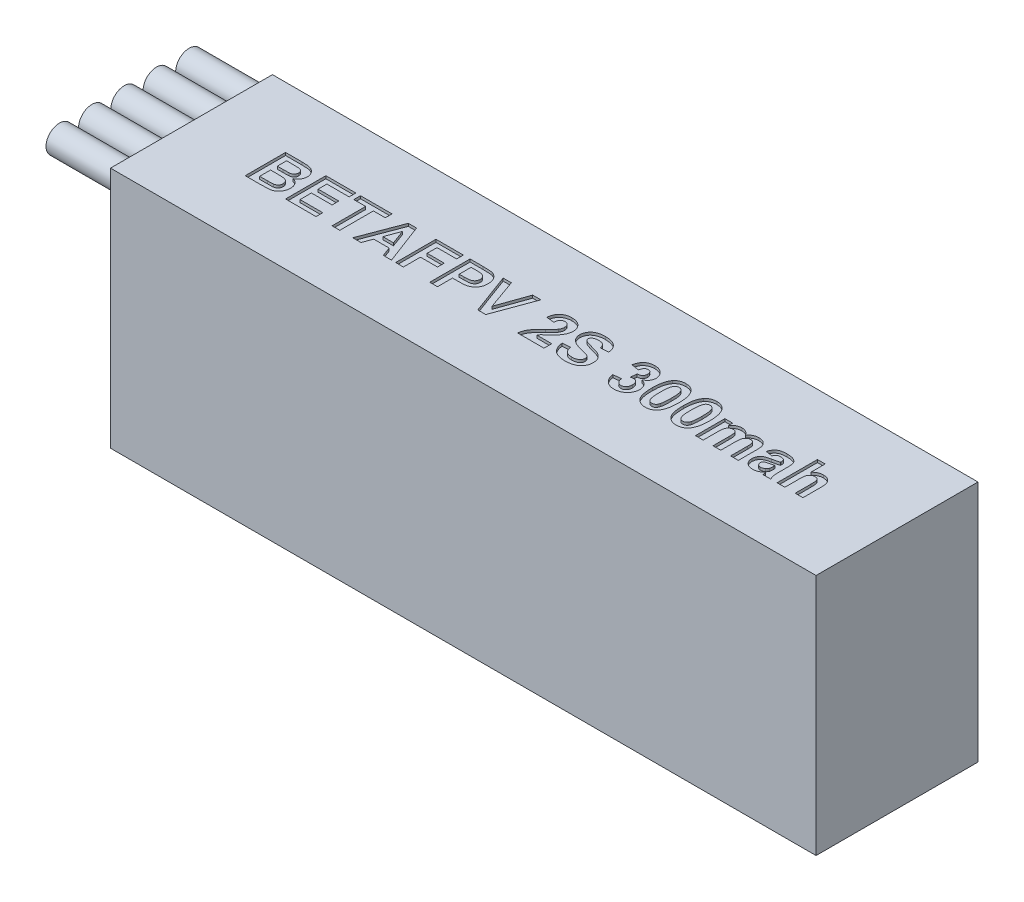
from build123d import *

# Parameters (mm, degrees)
SKETCH1_W           = 52.5
SKETCH1_H           = 18.05
BOSS_EXTRUDE1_DEPTH = 6.025
SKETCH3_R           = 1
BOSS_EXTRUDE6_DEPTH = 5
CUT_EXTRUDE1_DEPTH  = 0.2


with BuildPart() as part:
    # Sketch1 → Boss-Extrude1 (new, symmetric)
    with BuildSketch(Plane.XY):
        Rectangle(SKETCH1_W, SKETCH1_H)
    extrude(amount=BOSS_EXTRUDE1_DEPTH, both=True)

    # Sketch3 → Boss-Extrude6 (add)
    with BuildSketch(Plane.ZY.offset(26.25)):
        with Locations(Location((-4.825, 7.825, 0), (0, 0, 90))):
            Circle(SKETCH3_R)
        with Locations(Location((-2.4, 7.825, 0), (0, 0, 90))):
            Circle(SKETCH3_R)
        with Locations(Location((0, 7.825, 0), (0, 0, 90))):
            Circle(SKETCH3_R)
        with Locations(Location((2.4, 7.825, 0), (0, 0, 90))):
            Circle(SKETCH3_R)
        with Locations(Location((4.825, 7.825, 0), (0, 0, 90))):
            Circle(SKETCH3_R)
    extrude(amount=BOSS_EXTRUDE6_DEPTH)

    # Sketch4 → Cut-Extrude1 (cut)
    # profile 1 of 15: a face of its own
    with BuildSketch(Plane(origin=(0, 9.025, 0), x_dir=(1, 0, 0), z_dir=(0, 1, 0))):
        with BuildLine():
            Line((-20.75, 1.5), (-19.541466346, 1.5))
            add(Edge.make_bspline(
                [(-19.541466346, 1.5), (-19.512420126, 1.499827176), (-19.456328549, 1.499493433), (-19.37498057, 1.498563329), (-19.299473584, 1.495831839), (-19.229690011, 1.493486324), (-19.165861944, 1.48800114), (-19.107487734, 1.483691634), (-19.054751171, 1.477762875), (-18.992626126, 1.468168384), (-18.920385673, 1.453244829), (-18.838791849, 1.42564029), (-18.761448905, 1.391151119), (-18.689519378, 1.347303415), (-18.622764335, 1.296020769), (-18.560673232, 1.237711652), (-18.506110192, 1.170019844), (-18.456977035, 1.096139472), (-18.415505139, 1.016008486), (-18.386946603, 0.929803499), (-18.368721348, 0.839105092), (-18.366512341, 0.776932305), (-18.365384615, 0.745192308)],
                knots=[0, 0, 0, 0, 1.096610875, 2.117681168, 3.071055591, 3.949137991, 4.753059115, 5.489127199, 6.15892391, 6.75575099, 7.862330316, 8.938514814, 10.001276227, 11.05313779, 12.110449801, 13.174958802, 14.260456508, 15.384725817, 16.521138801, 17.654729897, 18.802709851, 20, 20, 20, 20], degree=3))
            add(Edge.make_bspline(
                [(-18.365384615, 0.745192308), (-18.366554227, 0.710628255), (-18.36886044, 0.64247561), (-18.390326188, 0.542536529), (-18.424518629, 0.446918017), (-18.472793445, 0.357171238), (-18.531920283, 0.274812605), (-18.601857452, 0.202491732), (-18.681577357, 0.140648344), (-18.741437629, 0.109874879), (-18.771634615, 0.094350962)],
                knots=[0, 0, 0, 0, 1.023065178, 2.01725758, 3.014298905, 4.023406433, 5.026736079, 6.009055718, 6.99565244, 8, 8, 8, 8], degree=3))
            add(Edge.make_bspline(
                [(-18.771634615, 0.094350962), (-18.751296367, 0.087423552), (-18.711082418, 0.073726282), (-18.653522339, 0.048574178), (-18.599591661, 0.019405368), (-18.549317466, -0.012860358), (-18.502318191, -0.048458875), (-18.459966971, -0.088570545), (-18.419833668, -0.130913304), (-18.38459974, -0.177612633), (-18.352707629, -0.226434974), (-18.325635993, -0.278144498), (-18.30219421, -0.331497456), (-18.282589413, -0.387033815), (-18.268614615, -0.445126057), (-18.257417137, -0.50504237), (-18.251688819, -0.567198013), (-18.250567561, -0.609165468), (-18.25, -0.630408654)],
                knots=[0, 0, 0, 0, 1.072651974, 2.1209089, 3.132484228, 4.131466326, 5.101889999, 6.071643115, 7.041396231, 8.011819904, 8.988565287, 9.95070344, 10.922775742, 11.897213062, 12.887138018, 13.903598663, 14.938838629, 16, 16, 16, 16], degree=3))
            add(Edge.make_bspline(
                [(-18.25, -0.630408654), (-18.251207134, -0.664332563), (-18.253615831, -0.732023781), (-18.271615714, -0.833004644), (-18.302015774, -0.932207053), (-18.34318373, -1.02898745), (-18.394318872, -1.120243523), (-18.454436033, -1.203560153), (-18.524576936, -1.276053646), (-18.602251918, -1.339930972), (-18.689779923, -1.392812289), (-18.787086167, -1.43343256), (-18.893555741, -1.464120377), (-18.968563051, -1.474314602), (-19.007211538, -1.479567308)],
                knots=[0, 0, 0, 0, 0.975059807, 1.945618526, 2.93861228, 3.952760547, 4.963632603, 5.940527786, 6.897802811, 7.855787948, 8.824773195, 9.82606706, 10.879852914, 12, 12, 12, 12], degree=3))
            add(Edge.make_bspline(
                [(-19.007211538, -1.479567308), (-19.022031497, -1.480817451), (-19.056051853, -1.483687252), (-19.113748484, -1.487255193), (-19.184689353, -1.48995216), (-19.26881286, -1.493140981), (-19.366377977, -1.495443404), (-19.477162964, -1.497015647), (-19.60135685, -1.499056109), (-19.688500731, -1.499674478), (-19.734375, -1.5)],
                knots=[0, 0, 0, 0, 0.490565993, 1.126131979, 1.906526787, 2.832178623, 3.902933831, 5.125497984, 6.486805064, 8, 8, 8, 8], degree=3))
            Line((-19.734375, -1.5), (-20.75, -1.5))
            Line((-20.75, -1.5), (-20.75, 1.5))
        make_face()
        with BuildLine():
            Line((-20.173076923, 1), (-20.173076923, 0.307692308))
            Line((-20.173076923, 0.307692308), (-19.755408654, 0.307692308))
            add(Edge.make_bspline(
                [(-19.755408654, 0.307692308), (-19.725961277, 0.307627432), (-19.669870283, 0.307503857), (-19.59014445, 0.308331952), (-19.519025968, 0.308718542), (-19.456719305, 0.309853128), (-19.403237252, 0.311725614), (-19.358772515, 0.313595444), (-19.323068148, 0.315011121), (-19.302278323, 0.317032644), (-19.293269231, 0.317908654)],
                knots=[0, 0, 0, 0, 1.528479216, 2.911428072, 4.138414629, 5.21998762, 6.145918986, 6.915989543, 7.530253335, 8, 8, 8, 8], degree=3))
            add(Edge.make_bspline(
                [(-19.293269231, 0.317908654), (-19.267288417, 0.321818175), (-19.217354887, 0.329332035), (-19.147480901, 0.351349413), (-19.086874473, 0.383193482), (-19.034862852, 0.422830942), (-18.993576477, 0.471461461), (-18.963278659, 0.527404162), (-18.945552208, 0.590894115), (-18.943416179, 0.635503776), (-18.942307692, 0.658653846)],
                knots=[0, 0, 0, 0, 1.162079002, 2.233444551, 3.225172046, 4.179556897, 5.110707885, 6.027301426, 6.976273101, 8, 8, 8, 8], degree=3))
            add(Edge.make_bspline(
                [(-18.942307692, 0.658653846), (-18.943003529, 0.681008405), (-18.944339363, 0.7239236), (-18.960933512, 0.784685566), (-18.985881568, 0.83925468), (-19.022348978, 0.886290311), (-19.068109947, 0.926012412), (-19.124118985, 0.95704083), (-19.190107138, 0.978391321), (-19.23763881, 0.985858896), (-19.262620192, 0.989783654)],
                knots=[0, 0, 0, 0, 1.044241546, 2.004684189, 2.928111627, 3.838334562, 4.769594837, 5.748424953, 6.81663206, 8, 8, 8, 8], degree=3))
            add(Edge.make_bspline(
                [(-19.262620192, 0.989783654), (-19.272430906, 0.990662317), (-19.29562519, 0.992739634), (-19.335937144, 0.994090042), (-19.387211574, 0.995990652), (-19.449709842, 0.997845551), (-19.523433636, 0.99897807), (-19.608173284, 0.999359767), (-19.703925001, 1.000191478), (-19.77143407, 1.00006618), (-19.807091346, 1)],
                knots=[0, 0, 0, 0, 0.433943041, 1.02591908, 1.776648879, 2.694999143, 3.780816848, 5.02540149, 6.428861738, 8, 8, 8, 8], degree=3))
            Line((-19.807091346, 1), (-20.173076923, 1))
        make_face(mode=Mode.SUBTRACT)
        with BuildLine():
            Line((-20.173076923, -0.192307692), (-20.173076923, -1))
            Line((-20.173076923, -1), (-19.584134615, -1))
            add(Edge.make_bspline(
                [(-19.584134615, -1), (-19.556689345, -1.000136143), (-19.504600174, -1.000394532), (-19.430291686, -0.998663874), (-19.363956469, -0.998093213), (-19.305284045, -0.995246152), (-19.254582728, -0.99309238), (-19.211643896, -0.990407341), (-19.176802815, -0.986137355), (-19.156242251, -0.98282235), (-19.147235577, -0.981370192)],
                knots=[0, 0, 0, 0, 1.504773752, 2.85595359, 4.075347731, 5.141676974, 6.076328919, 6.858106537, 7.499786952, 8, 8, 8, 8], degree=3))
            add(Edge.make_bspline(
                [(-19.147235577, -0.981370192), (-19.124363241, -0.976544284), (-19.079924074, -0.967167919), (-19.018331963, -0.940262374), (-18.962820676, -0.906141258), (-18.91474361, -0.862288476), (-18.875226754, -0.809754048), (-18.846692773, -0.748422263), (-18.829484863, -0.679014717), (-18.827802093, -0.63011217), (-18.826923077, -0.604567308)],
                knots=[0, 0, 0, 0, 1.031056579, 2.003262591, 2.954260215, 3.900917722, 4.862741126, 5.841340256, 6.872396835, 8, 8, 8, 8], degree=3))
            add(Edge.make_bspline(
                [(-18.826923077, -0.604567308), (-18.827632465, -0.582660389), (-18.829013207, -0.540021129), (-18.842528818, -0.478948575), (-18.864392527, -0.423108272), (-18.894840474, -0.372881276), (-18.932881457, -0.327636782), (-18.979907765, -0.28977347), (-19.03420073, -0.258227411), (-19.085957917, -0.237445222), (-19.135037145, -0.22411221), (-19.181848427, -0.215365494), (-19.238265588, -0.208441804), (-19.304015119, -0.202585129), (-19.379363828, -0.197901633), (-19.464109212, -0.194209472), (-19.558487759, -0.192664158), (-19.624599148, -0.192430287), (-19.659254808, -0.192307692)],
                knots=[0, 0, 0, 0, 0.992165387, 1.931134082, 2.820086661, 3.700270762, 4.583075858, 5.486803518, 6.423132184, 7.421722103, 8.005700193, 8.727213115, 9.57900282, 10.582332745, 11.720121093, 13.002085041, 14.428489784, 16, 16, 16, 16], degree=3))
            Line((-19.659254808, -0.192307692), (-20.173076923, -0.192307692))
        make_face(mode=Mode.SUBTRACT)
    # profile 2 of 15: a face of its own
    with BuildSketch(Plane(origin=(0, 9.025, 0), x_dir=(1, 0, 0), z_dir=(0, 1, 0))):
        Polygon((-17.75, -1.5), (-17.75, 1.5), (-15.519230769, 1.5), (-15.519230769, 1), (-17.173076923, 1), (-17.173076923, 0.346153846), (-15.634615385, 0.346153846), (-15.634615385, -0.153846154), (-17.173076923, -0.153846154), (-17.173076923, -1), (-15.480769231, -1), (-15.480769231, -1.5), align=None)
    # profile 3 of 15: a face of its own
    with BuildSketch(Plane(origin=(0, 9.025, 0), x_dir=(1, 0, 0), z_dir=(0, 1, 0))):
        Polygon((-14.288461538, -1.5), (-14.288461538, 1), (-15.173076923, 1), (-15.173076923, 1.5), (-12.826923077, 1.5), (-12.826923077, 1), (-13.711538462, 1), (-13.711538462, -1.5), align=None)
    # profile 4 of 15: a face of its own
    with BuildSketch(Plane(origin=(0, 9.025, 0), x_dir=(1, 0, 0), z_dir=(0, 1, 0))):
        Polygon((-9.865384615, -1.5), (-10.477163462, -1.5), (-10.730168269, -0.807692308), (-11.881610577, -0.807692308), (-12.134615385, -1.5), (-12.75, -1.5), (-11.615985577, 1.5), (-11.004807692, 1.5), align=None)
        Polygon((-10.913461538, -0.307692308), (-11.307692308, 0.769230769), (-11.700721154, -0.307692308), align=None, mode=Mode.SUBTRACT)
    # profile 5 of 15: a face of its own
    with BuildSketch(Plane(origin=(0, 9.025, 0), x_dir=(1, 0, 0), z_dir=(0, 1, 0))):
        Polygon((-9.557692308, -1.5), (-9.557692308, 1.5), (-7.519230769, 1.5), (-7.519230769, 1), (-8.980769231, 1), (-8.980769231, 0.269230769), (-7.711538462, 0.269230769), (-7.711538462, -0.230769231), (-8.980769231, -0.230769231), (-8.980769231, -1.5), align=None)
    # profile 6 of 15: a face of its own
    with BuildSketch(Plane(origin=(0, 9.025, 0), x_dir=(1, 0, 0), z_dir=(0, 1, 0))):
        with BuildLine():
            Line((-7.019230769, -1.5), (-7.019230769, 1.5))
            Line((-7.019230769, 1.5), (-6.059495192, 1.5))
            add(Edge.make_bspline(
                [(-6.059495192, 1.5), (-6.01602422, 1.499952528), (-5.932880818, 1.499861731), (-5.814281784, 1.497339023), (-5.707501122, 1.493767852), (-5.612697311, 1.48932011), (-5.529536763, 1.482683224), (-5.458392525, 1.47499781), (-5.398816607, 1.466730344), (-5.363734114, 1.458174623), (-5.347956731, 1.454326923)],
                knots=[0, 0, 0, 0, 1.460485487, 2.793352117, 3.985295279, 5.050041172, 5.981765236, 6.787433016, 7.454681457, 8, 8, 8, 8], degree=3))
            add(Edge.make_bspline(
                [(-5.347956731, 1.454326923), (-5.326976648, 1.448344693), (-5.285336098, 1.436471368), (-5.225678176, 1.411159324), (-5.168177386, 1.381824016), (-5.113556163, 1.346861631), (-5.061628834, 1.306892876), (-5.012241046, 1.2622437), (-4.965129422, 1.212712548), (-4.92094569, 1.158397265), (-4.880478589, 1.099571738), (-4.845504846, 1.036148995), (-4.816204162, 0.968404702), (-4.791240466, 0.896847951), (-4.772822133, 0.820711536), (-4.759932648, 0.740524462), (-4.750959958, 0.656251657), (-4.750324664, 0.598582223), (-4.75, 0.569110577)],
                knots=[0, 0, 0, 0, 0.907145743, 1.80047177, 2.69161667, 3.591261238, 4.495029544, 5.415863088, 6.359363025, 7.337192411, 8.326890979, 9.326929023, 10.346104993, 11.395420813, 12.477187422, 13.601053412, 14.774031606, 16, 16, 16, 16], degree=3))
            add(Edge.make_bspline(
                [(-4.75, 0.569110577), (-4.750925939, 0.524354532), (-4.752708422, 0.438196689), (-4.772651246, 0.314678977), (-4.803068959, 0.201853511), (-4.847526645, 0.100807032), (-4.901729798, 0.011143018), (-4.961435688, -0.069688667), (-5.02961104, -0.139251674), (-5.103268494, -0.198668623), (-5.181110961, -0.247292989), (-5.259094339, -0.28874457), (-5.338270899, -0.320613871), (-5.392253301, -0.334499581), (-5.418870192, -0.341346154)],
                knots=[0, 0, 0, 0, 1.312386234, 2.526415563, 3.661883817, 4.733421185, 5.753802465, 6.732107337, 7.675884281, 8.604170108, 9.50284679, 10.365392406, 11.194030444, 12, 12, 12, 12], degree=3))
            add(Edge.make_bspline(
                [(-5.418870192, -0.341346154), (-5.437868024, -0.344959988), (-5.477913186, -0.352577519), (-5.541422419, -0.360170811), (-5.610841451, -0.368575757), (-5.68645581, -0.374057935), (-5.76817402, -0.379191766), (-5.855964351, -0.381615616), (-5.949701341, -0.384535864), (-6.014219863, -0.384588337), (-6.047475962, -0.384615385)],
                knots=[0, 0, 0, 0, 0.735353946, 1.55003838, 2.431865514, 3.394945452, 4.432993119, 5.54609699, 6.735134699, 8, 8, 8, 8], degree=3))
            Line((-6.047475962, -0.384615385), (-6.442307692, -0.384615385))
            Line((-6.442307692, -0.384615385), (-6.442307692, -1.5))
            Line((-6.442307692, -1.5), (-7.019230769, -1.5))
        make_face()
        with BuildLine():
            Line((-6.442307692, 1), (-6.442307692, 0.115384615))
            Line((-6.442307692, 0.115384615), (-6.096153846, 0.115384615))
            add(Edge.make_bspline(
                [(-6.096153846, 0.115384615), (-6.066303468, 0.115423269), (-6.009195939, 0.115497219), (-5.927259303, 0.118151569), (-5.853090183, 0.121391697), (-5.786533604, 0.12675477), (-5.72799132, 0.133823173), (-5.677071287, 0.142277874), (-5.633714159, 0.15135065), (-5.586829329, 0.166385695), (-5.536700071, 0.190711027), (-5.483167915, 0.225672638), (-5.436139979, 0.267473368), (-5.397006503, 0.316566878), (-5.36574752, 0.371112611), (-5.343366065, 0.430551566), (-5.328914381, 0.493898631), (-5.327594351, 0.537780785), (-5.326923077, 0.560096154)],
                knots=[0, 0, 0, 0, 1.411705958, 2.700771114, 3.876961699, 4.922619712, 5.858038221, 6.66485904, 7.363650596, 7.950905807, 8.989198271, 9.987739806, 10.967313358, 11.951275539, 12.944273208, 13.927870418, 14.946261014, 16, 16, 16, 16], degree=3))
            add(Edge.make_bspline(
                [(-5.326923077, 0.560096154), (-5.327867821, 0.587275925), (-5.329699556, 0.639973917), (-5.34989848, 0.715024653), (-5.381063112, 0.783134106), (-5.425619687, 0.842183083), (-5.47944298, 0.891838416), (-5.539938116, 0.933153419), (-5.608396995, 0.962065973), (-5.656847532, 0.97326852), (-5.681490385, 0.978966346)],
                knots=[0, 0, 0, 0, 1.085904563, 2.105425768, 3.088705091, 4.068969419, 5.045188284, 6.010769642, 6.988240112, 8, 8, 8, 8], degree=3))
            add(Edge.make_bspline(
                [(-5.681490385, 0.978966346), (-5.692094767, 0.980662431), (-5.715633208, 0.984427212), (-5.754758887, 0.98835623), (-5.801044572, 0.991929668), (-5.854546055, 0.994863567), (-5.915051269, 0.997157197), (-5.982759789, 0.999166983), (-6.057493291, 0.999328442), (-6.10977613, 0.999769945), (-6.137019231, 1)],
                knots=[0, 0, 0, 0, 0.564603001, 1.253243608, 2.066786758, 3.005752288, 4.070476343, 5.250658742, 6.567396469, 8, 8, 8, 8], degree=3))
            Line((-6.137019231, 1), (-6.442307692, 1))
        make_face(mode=Mode.SUBTRACT)
    # profile 7 of 15: a face of its own
    with BuildSketch(Plane(origin=(0, 9.025, 0), x_dir=(1, 0, 0), z_dir=(0, 1, 0))):
        Polygon((-3.448317308, -1.5), (-4.557692308, 1.5), (-3.948317308, 1.5), (-3.153846154, -0.730769231), (-2.362379808, 1.5), (-1.75, 1.5), (-2.855168269, -1.5), align=None)
    # profile 8 of 15: a face of its own
    with BuildSketch(Plane(origin=(0, 9.025, 0), x_dir=(1, 0, 0), z_dir=(0, 1, 0))):
        with BuildLine():
            Line((1.480769231, -0.923076923), (1.480769231, -1.5))
            Line((1.480769231, -1.5), (-0.480769231, -1.5))
            add(Edge.make_bspline(
                [(-0.480769231, -1.5), (-0.474127916, -1.450693552), (-0.46084901, -1.352108304), (-0.419795382, -1.20810007), (-0.365002849, -1.067572639), (-0.305535963, -0.953217419), (-0.246389558, -0.861165403), (-0.192726021, -0.785737269), (-0.128707392, -0.705484973), (-0.055262651, -0.619760655), (0.027202318, -0.528296343), (0.119302755, -0.431432081), (0.221477994, -0.329631587), (0.293360095, -0.260504043), (0.330528846, -0.224759615)],
                knots=[0, 0, 0, 0, 1.156289446, 2.311930546, 3.473459201, 4.661751613, 5.303057008, 6.018253237, 6.81459331, 7.690699809, 8.644447906, 9.679642995, 10.800191253, 12, 12, 12, 12], degree=3))
            add(Edge.make_bspline(
                [(0.330528846, -0.224759615), (0.360189935, -0.196128544), (0.416655912, -0.141623417), (0.497063574, -0.063574284), (0.567750194, 0.008175054), (0.630193732, 0.071765264), (0.682951653, 0.128815514), (0.726717941, 0.178429839), (0.762046888, 0.220810282), (0.781181077, 0.247696462), (0.789663462, 0.259615385)],
                knots=[0, 0, 0, 0, 1.480720495, 2.818855715, 4.024636094, 5.098235712, 6.019786162, 6.815086302, 7.474715479, 8, 8, 8, 8], degree=3))
            add(Edge.make_bspline(
                [(0.789663462, 0.259615385), (0.807033314, 0.288468565), (0.840537747, 0.344123008), (0.877278138, 0.431640625), (0.899331089, 0.519140164), (0.902357351, 0.577606856), (0.903846154, 0.606370192)],
                knots=[0, 0, 0, 0, 1.0911822, 2.104764037, 3.067617678, 4, 4, 4, 4], degree=3))
            add(Edge.make_bspline(
                [(0.903846154, 0.606370192), (0.902765654, 0.636302311), (0.900721432, 0.692931545), (0.883580282, 0.772845866), (0.853183232, 0.841543546), (0.811332089, 0.899235453), (0.758411234, 0.944436841), (0.696545216, 0.97783628), (0.624828415, 0.996301817), (0.574421617, 0.998730611), (0.548076923, 1)],
                knots=[0, 0, 0, 0, 1.193122327, 2.257294386, 3.237245624, 4.168877528, 5.075331632, 5.990371598, 6.949684428, 8, 8, 8, 8], degree=3))
            add(Edge.make_bspline(
                [(0.548076923, 1), (0.521910212, 0.998814485), (0.471361774, 0.996524327), (0.399521478, 0.976517818), (0.336674477, 0.941884447), (0.291886362, 0.902416379), (0.261629866, 0.86403655), (0.241014145, 0.830591058), (0.223245003, 0.792586721), (0.20750006, 0.750451407), (0.195063336, 0.70370241), (0.18504757, 0.65269577), (0.176976312, 0.597157001), (0.17440951, 0.558520269), (0.173076923, 0.538461538)],
                knots=[0, 0, 0, 0, 1.402788338, 2.709884207, 3.961032948, 5.225417836, 5.883680772, 6.578928686, 7.329201998, 8.132101139, 8.990263233, 9.922304639, 10.921339128, 12, 12, 12, 12], degree=3))
            Line((0.173076923, 0.538461538), (-0.403846154, 0.594951923))
            add(Edge.make_bspline(
                [(-0.403846154, 0.594951923), (-0.399207782, 0.633901503), (-0.390214719, 0.709418514), (-0.367772381, 0.81788698), (-0.339349991, 0.917954036), (-0.303592558, 1.009433976), (-0.261977981, 1.092908523), (-0.212383569, 1.16712509), (-0.156542205, 1.232905787), (-0.094405627, 1.290215603), (-0.02636886, 1.339236856), (0.045023519, 1.382995846), (0.121166717, 1.418892129), (0.201222394, 1.448476059), (0.285154372, 1.4721193), (0.373350848, 1.48775189), (0.465267506, 1.498747914), (0.5280102, 1.499576348), (0.560096154, 1.5)],
                knots=[0, 0, 0, 0, 1.270971563, 2.464210789, 3.586263665, 4.638946707, 5.643716971, 6.603612468, 7.52484387, 8.434700188, 9.336036235, 10.239171475, 11.145359471, 12.059630629, 13.003312604, 13.96741569, 14.960557767, 16, 16, 16, 16], degree=3))
            add(Edge.make_bspline(
                [(0.560096154, 1.5), (0.594977731, 1.499329594), (0.662913982, 1.498023895), (0.762088848, 1.487241418), (0.855256509, 1.468440608), (0.943231501, 1.443536275), (1.02511037, 1.410287168), (1.101575408, 1.370090381), (1.17142319, 1.321420363), (1.235694892, 1.266931299), (1.293148651, 1.207010996), (1.343472945, 1.143095862), (1.385634473, 1.075230427), (1.421014469, 1.004241895), (1.447283878, 0.928987958), (1.466424911, 0.850509173), (1.479116187, 0.768439417), (1.480212122, 0.712387636), (1.480769231, 0.683894231)],
                knots=[0, 0, 0, 0, 1.210756838, 2.35810096, 3.457354827, 4.507168606, 5.527358126, 6.519769748, 7.499700793, 8.476517721, 9.440526811, 10.376769937, 11.295256217, 12.209626307, 13.124630862, 14.055668209, 15.011616881, 16, 16, 16, 16], degree=3))
            add(Edge.make_bspline(
                [(1.480769231, 0.683894231), (1.480035248, 0.651192854), (1.478579138, 0.586318341), (1.464637966, 0.490414429), (1.44333857, 0.396722049), (1.41185974, 0.305012225), (1.371957879, 0.213085053), (1.320523424, 0.120734192), (1.260804131, 0.025174505), (1.214046278, -0.036609003), (1.189903846, -0.068509615)],
                knots=[0, 0, 0, 0, 0.953409949, 1.89141903, 2.821310783, 3.752688675, 4.715703262, 5.740811754, 6.833515735, 8, 8, 8, 8], degree=3))
            add(Edge.make_bspline(
                [(1.189903846, -0.068509615), (1.180779067, -0.080002302), (1.161235904, -0.104616973), (1.127987849, -0.142359765), (1.089456213, -0.183586791), (1.046185238, -0.229069727), (0.996745599, -0.277197898), (0.942916137, -0.329983985), (0.8823282, -0.384727806), (0.819573779, -0.442794953), (0.756546584, -0.49931089), (0.698615505, -0.552988501), (0.645994809, -0.600481657), (0.601135141, -0.644412201), (0.561397865, -0.681781902), (0.528215246, -0.714507036), (0.500966358, -0.741795355), (0.463419143, -0.784330921), (0.415644573, -0.841860291), (0.38203321, -0.896831231), (0.365985577, -0.923076923)],
                knots=[0, 0, 0, 0, 0.665555651, 1.425465941, 2.280616993, 3.225313414, 4.272635571, 5.410053715, 6.644756443, 7.976022804, 9.288331007, 10.484517221, 11.558462543, 12.503158964, 13.33222979, 14.032602617, 14.617328242, 15.080653724, 16.606167857, 18, 18, 18, 18], degree=3))
            Line((0.365985577, -0.923076923), (1.480769231, -0.923076923))
        make_face()
    # profile 9 of 15: a face of its own
    with BuildSketch(Plane(origin=(0, 9.025, 0), x_dir=(1, 0, 0), z_dir=(0, 1, 0))):
        with BuildLine():
            Line((1.826923077, -0.5), (2.403846154, -0.461538462))
            add(Edge.make_bspline(
                [(2.403846154, -0.461538462), (2.408442337, -0.485674891), (2.417370129, -0.532558371), (2.437206009, -0.599373731), (2.459039822, -0.661664596), (2.485132425, -0.718763001), (2.513697161, -0.771724378), (2.547080633, -0.819039985), (2.582953926, -0.862220489), (2.623092837, -0.89971503), (2.666823659, -0.932553268), (2.714364605, -0.960558811), (2.765200529, -0.984798114), (2.819455729, -1.004758412), (2.877689388, -1.019658871), (2.939394207, -1.030259665), (3.004658681, -1.03704812), (3.049261751, -1.037982687), (3.072115385, -1.038461538)],
                knots=[0, 0, 0, 0, 1.204560339, 2.339781841, 3.415289417, 4.440034832, 5.416475564, 6.362424008, 7.275913008, 8.16578645, 9.05021719, 9.95355393, 10.867835453, 11.809845306, 12.784702352, 13.812224031, 14.87903166, 16, 16, 16, 16], degree=3))
            add(Edge.make_bspline(
                [(3.072115385, -1.038461538), (3.096170279, -1.038199101), (3.142958289, -1.037688647), (3.210759288, -1.031356013), (3.274156301, -1.022283835), (3.332589512, -1.007922789), (3.387150103, -0.991862231), (3.436483018, -0.969889677), (3.48138658, -0.944547513), (3.521745107, -0.915790722), (3.556966032, -0.883897378), (3.587779054, -0.850601761), (3.614615161, -0.81662321), (3.635737076, -0.780453904), (3.652830759, -0.743556682), (3.664128487, -0.704830833), (3.671760771, -0.665165588), (3.672635971, -0.638057097), (3.673076923, -0.624399038)],
                knots=[0, 0, 0, 0, 1.417779877, 2.757654889, 4.012140507, 5.189587551, 6.302846416, 7.360586765, 8.365575446, 9.33904572, 10.275781718, 11.161696098, 12.012180333, 12.822428111, 13.625933072, 14.403138519, 15.195454004, 16, 16, 16, 16], degree=3))
            add(Edge.make_bspline(
                [(3.673076923, -0.624399038), (3.672536133, -0.607286599), (3.671478156, -0.573808614), (3.658741179, -0.525948169), (3.63964003, -0.481606849), (3.6108803, -0.441439576), (3.572220144, -0.404732543), (3.522905262, -0.370394012), (3.461559107, -0.339502764), (3.416048239, -0.322271568), (3.391826923, -0.313100962)],
                knots=[0, 0, 0, 0, 0.90494901, 1.770400303, 2.607161909, 3.452839393, 4.36912122, 5.420987164, 6.627424851, 8, 8, 8, 8], degree=3))
            add(Edge.make_bspline(
                [(3.391826923, -0.313100962), (3.381434198, -0.309618311), (3.358176966, -0.301824706), (3.318502598, -0.290680584), (3.270713767, -0.276764538), (3.214119896, -0.26094673), (3.148740013, -0.244769276), (3.075304326, -0.224840488), (2.992917573, -0.205009715), (2.935279702, -0.190370643), (2.905048077, -0.182692308)],
                knots=[0, 0, 0, 0, 0.521821638, 1.167752076, 1.961721917, 2.891982557, 3.96540661, 5.168436773, 6.514817513, 8, 8, 8, 8], degree=3))
            add(Edge.make_bspline(
                [(2.905048077, -0.182692308), (2.865677529, -0.172862401), (2.789718494, -0.153897202), (2.681383517, -0.120159459), (2.581605022, -0.086639142), (2.491343714, -0.0502678), (2.409603973, -0.013510416), (2.337707965, 0.026213622), (2.274155378, 0.066841303), (2.23712181, 0.097207424), (2.219350962, 0.111778846)],
                knots=[0, 0, 0, 0, 1.293880989, 2.496331788, 3.617634808, 4.64976062, 5.598842568, 6.473791081, 7.267636666, 8, 8, 8, 8], degree=3))
            add(Edge.make_bspline(
                [(2.219350962, 0.111778846), (2.1973128, 0.132413082), (2.154104945, 0.172868411), (2.097228511, 0.239344279), (2.049436819, 0.309565398), (2.010099024, 0.383013443), (1.979809666, 0.460111249), (1.958340959, 0.540342757), (1.944445632, 0.623917363), (1.943027709, 0.680833649), (1.942307692, 0.709735577)],
                knots=[0, 0, 0, 0, 1.064429417, 2.086912298, 3.078678339, 4.055528992, 5.020032834, 5.993708893, 6.981211098, 8, 8, 8, 8], degree=3))
            add(Edge.make_bspline(
                [(1.942307692, 0.709735577), (1.943709931, 0.747134327), (1.946491554, 0.821322283), (1.972000851, 0.930368451), (2.011737366, 1.035589605), (2.057822301, 1.119139098), (2.10209998, 1.182344605), (2.13886937, 1.227700298), (2.179264096, 1.270148867), (2.223837482, 1.308654857), (2.270934407, 1.345473783), (2.322379587, 1.37816943), (2.376714396, 1.408966921), (2.455343054, 1.445475914), (2.562099197, 1.48352187), (2.700994674, 1.515592197), (2.852224345, 1.534870606), (2.957072341, 1.537235659), (3.011418269, 1.538461538)],
                knots=[0, 0, 0, 0, 1.180131776, 2.341029169, 3.518901375, 4.725685298, 5.343762192, 5.955650671, 6.568945152, 7.192346361, 7.815201106, 8.455999361, 9.116257477, 9.787318263, 11.192748436, 12.688084276, 14.283332633, 16, 16, 16, 16], degree=3))
            add(Edge.make_bspline(
                [(3.011418269, 1.538461538), (3.055916761, 1.537866482), (3.142465377, 1.53670911), (3.267927648, 1.52500558), (3.385116217, 1.50679042), (3.493619854, 1.480642643), (3.593489116, 1.446094565), (3.685111124, 1.404941273), (3.768408022, 1.356081989), (3.842365752, 1.299236327), (3.908255001, 1.23656763), (3.965732833, 1.168115224), (4.015018997, 1.094743622), (4.056431581, 1.016506443), (4.088952774, 0.933001434), (4.112838306, 0.844332791), (4.128636405, 0.75070922), (4.132596246, 0.686557414), (4.134615385, 0.653846154)],
                knots=[0, 0, 0, 0, 1.325124071, 2.577337985, 3.749592149, 4.855247722, 5.896868755, 6.892903601, 7.842551483, 8.766257401, 9.665194363, 10.546067736, 11.423174165, 12.293291263, 13.177512979, 14.086532529, 15.024315359, 16, 16, 16, 16], degree=3))
            Line((4.134615385, 0.653846154), (3.557692308, 0.615384615))
            add(Edge.make_bspline(
                [(3.557692308, 0.615384615), (3.554364184, 0.633475376), (3.547878018, 0.668732386), (3.533775315, 0.719227589), (3.517868151, 0.765929891), (3.499249639, 0.808838995), (3.476760727, 0.847186356), (3.452286328, 0.882178404), (3.425151304, 0.913348888), (3.394457205, 0.939844261), (3.361258812, 0.963953965), (3.323424343, 0.98327845), (3.282539105, 1.001207319), (3.237047663, 1.014685432), (3.187823618, 1.025376756), (3.134838296, 1.033302608), (3.077981867, 1.037172455), (3.038866739, 1.038022007), (3.018629808, 1.038461538)],
                knots=[0, 0, 0, 0, 1.151066407, 2.24330871, 3.278475654, 4.238599069, 5.165719782, 6.056502506, 6.909492653, 7.744782051, 8.590364415, 9.471203867, 10.39832458, 11.382154319, 12.435022857, 13.550631277, 14.73277401, 16, 16, 16, 16], degree=3))
            add(Edge.make_bspline(
                [(3.018629808, 1.038461538), (2.997588926, 1.038073505), (2.95665295, 1.037318567), (2.896998322, 1.032685629), (2.841037805, 1.024133671), (2.788496562, 1.013001143), (2.739444775, 0.997856108), (2.693985958, 0.979389219), (2.651912133, 0.957648006), (2.626257349, 0.94054277), (2.613581731, 0.932091346)],
                knots=[0, 0, 0, 0, 1.186678824, 2.308736671, 3.37120409, 4.377216403, 5.334874112, 6.262130804, 7.141346615, 8, 8, 8, 8], degree=3))
            add(Edge.make_bspline(
                [(2.613581731, 0.932091346), (2.59907555, 0.920546461), (2.57098158, 0.898187603), (2.540746523, 0.853790513), (2.522544949, 0.80364533), (2.520354183, 0.768184264), (2.519230769, 0.75)],
                knots=[0, 0, 0, 0, 1.037857257, 2.010007357, 2.979541333, 4, 4, 4, 4], degree=3))
            add(Edge.make_bspline(
                [(2.519230769, 0.75), (2.520149517, 0.733005598), (2.521959305, 0.69952933), (2.540213341, 0.651975567), (2.568285563, 0.607913585), (2.594514449, 0.583978539), (2.608173077, 0.571514423)],
                knots=[0, 0, 0, 0, 0.98538058, 1.941042925, 2.927803204, 4, 4, 4, 4], degree=3))
            add(Edge.make_bspline(
                [(2.608173077, 0.571514423), (2.619012958, 0.563424587), (2.64323558, 0.545347169), (2.687606622, 0.522369061), (2.741163635, 0.497482383), (2.805127588, 0.473152906), (2.879073379, 0.448868592), (2.963005504, 0.42351296), (3.056975586, 0.397816906), (3.158588373, 0.372931535), (3.261753971, 0.348470646), (3.360202058, 0.32172799), (3.451744622, 0.295655968), (3.535957206, 0.268328259), (3.613273909, 0.241724818), (3.683319156, 0.214401169), (3.746573903, 0.187790992), (3.820335951, 0.151200113), (3.903937813, 0.10163629), (3.991561996, 0.029587006), (4.069054404, -0.051401094), (4.123049055, -0.127767286), (4.160140555, -0.193444244), (4.184023567, -0.245796426), (4.204684246, -0.300962426), (4.221501982, -0.359003205), (4.233690794, -0.420000434), (4.243777746, -0.483488094), (4.248931356, -0.549993464), (4.249639952, -0.595345394), (4.25, -0.618389423)],
                knots=[0, 0, 0, 0, 0.511875881, 1.143829537, 1.88775736, 2.750598373, 3.734912702, 4.837306479, 6.073130119, 7.42648979, 8.801963576, 10.091065733, 11.292408984, 12.408830014, 13.446061236, 14.39066453, 15.257936293, 16.045629259, 17.510392066, 18.929669597, 20.331293837, 21.746891395, 22.460690638, 23.187651344, 23.925159671, 24.69163991, 25.474819891, 26.281170188, 27.126635539, 28, 28, 28, 28], degree=3))
            add(Edge.make_bspline(
                [(4.25, -0.618389423), (4.249504922, -0.63964117), (4.248521744, -0.68184508), (4.241651034, -0.744486337), (4.231025653, -0.806015201), (4.215296439, -0.866508806), (4.194430032, -0.925848149), (4.170936115, -0.984889659), (4.141558294, -1.042345767), (4.108122328, -1.098264059), (4.071240938, -1.152602572), (4.029447472, -1.202728614), (3.985196716, -1.250314508), (3.935661165, -1.292695711), (3.883899748, -1.333303851), (3.827544954, -1.369267103), (3.767917092, -1.401810662), (3.704639146, -1.430691557), (3.637486761, -1.455858647), (3.566547154, -1.478259107), (3.491181201, -1.496592163), (3.412017347, -1.512305901), (3.328765888, -1.524255793), (3.241530906, -1.532599596), (3.15029257, -1.537304998), (3.088146269, -1.538071235), (3.056490385, -1.538461538)],
                knots=[0, 0, 0, 0, 0.900570041, 1.788444861, 2.667795364, 3.545012114, 4.433698372, 5.332345486, 6.235991676, 7.164928091, 8.092777575, 9.015680987, 9.928493428, 10.842962589, 11.775229507, 12.714851019, 13.672254427, 14.652424454, 15.660007982, 16.709910502, 17.803296389, 18.945495772, 20.129342395, 21.366102753, 22.658353839, 24, 24, 24, 24], degree=3))
            add(Edge.make_bspline(
                [(3.056490385, -1.538461538), (3.010784172, -1.537715307), (2.921793092, -1.536262376), (2.792505037, -1.523257503), (2.671241399, -1.503352607), (2.558199588, -1.474463889), (2.453241438, -1.437377295), (2.356414821, -1.3916948), (2.268188075, -1.337143476), (2.187468465, -1.275046284), (2.115331453, -1.204271657), (2.050465707, -1.126286017), (1.993746283, -1.040387119), (1.945210463, -0.946709318), (1.903631178, -0.845759036), (1.869340341, -0.737489919), (1.843521144, -0.62138558), (1.832551454, -0.541161647), (1.826923077, -0.5)],
                knots=[0, 0, 0, 0, 1.217954099, 2.371385517, 3.459848295, 4.490682126, 5.476952527, 6.422732854, 7.338496285, 8.236688651, 9.131557988, 10.026443255, 10.935708282, 11.869506048, 12.834296687, 13.842423496, 14.892981177, 16, 16, 16, 16], degree=3))
        make_face()
    # profile 10 of 15: a face of its own
    with BuildSketch(Plane(origin=(0, 9.025, 0), x_dir=(1, 0, 0), z_dir=(0, 1, 0))):
        with BuildLine():
            Line((5.75, -0.647836538), (6.326923077, -0.576923077))
            add(Edge.make_bspline(
                [(6.326923077, -0.576923077), (6.331905406, -0.612396853), (6.34136257, -0.679731077), (6.370850382, -0.772930188), (6.409345247, -0.854033481), (6.460310516, -0.920485689), (6.519234947, -0.973336456), (6.584949309, -1.011047401), (6.656859185, -1.034828641), (6.70694557, -1.037231912), (6.732572115, -1.038461538)],
                knots=[0, 0, 0, 0, 1.26631894, 2.403651751, 3.447242243, 4.428907923, 5.348362865, 6.231623936, 7.095215805, 8, 8, 8, 8], degree=3))
            add(Edge.make_bspline(
                [(6.732572115, -1.038461538), (6.746416221, -1.038164244), (6.77383923, -1.037575349), (6.814151756, -1.031396688), (6.852885768, -1.021240441), (6.889659099, -1.006626359), (6.924647299, -0.988468162), (6.958311104, -0.96684422), (6.989236364, -0.939836815), (7.019429406, -0.910287854), (7.046223055, -0.876651249), (7.069825068, -0.840156943), (7.090542949, -0.801166906), (7.106601431, -0.758675829), (7.119171618, -0.713604126), (7.1281581, -0.665756148), (7.133627265, -0.615312259), (7.134281498, -0.580743183), (7.134615385, -0.563100962)],
                knots=[0, 0, 0, 0, 0.951760839, 1.885289532, 2.797832748, 3.70117291, 4.60103766, 5.506897018, 6.445598779, 7.420035506, 8.410036365, 9.396193293, 10.407074535, 11.440988179, 12.514285005, 13.622404236, 14.786601276, 16, 16, 16, 16], degree=3))
            add(Edge.make_bspline(
                [(7.134615385, -0.563100962), (7.133364746, -0.53035805), (7.130979015, -0.467897375), (7.112543716, -0.379282589), (7.080573613, -0.301386596), (7.035781932, -0.235606812), (6.982556669, -0.182691915), (6.922933407, -0.142916835), (6.856348631, -0.12006635), (6.810059991, -0.116956704), (6.786658654, -0.115384615)],
                knots=[0, 0, 0, 0, 1.241512862, 2.368321189, 3.414110003, 4.41529485, 5.36642979, 6.245396713, 7.112955941, 8, 8, 8, 8], degree=3))
            add(Edge.make_bspline(
                [(6.786658654, -0.115384615), (6.769998356, -0.115810922), (6.734680284, -0.116714648), (6.679744934, -0.12610446), (6.619837698, -0.139062825), (6.579045423, -0.151527913), (6.557692308, -0.158052885)],
                knots=[0, 0, 0, 0, 0.854525515, 1.811503923, 2.854410343, 4, 4, 4, 4], degree=3))
            Line((6.557692308, -0.158052885), (6.611778846, 0.307692308))
            add(Edge.make_bspline(
                [(6.611778846, 0.307692308), (6.627811154, 0.307417287), (6.658921772, 0.306883611), (6.704352606, 0.310650245), (6.746877268, 0.317527277), (6.786396533, 0.328685224), (6.822947199, 0.342222092), (6.85684893, 0.359230158), (6.88727234, 0.380395819), (6.924314815, 0.412345272), (6.962212615, 0.460219614), (6.996474625, 0.525866091), (7.015564729, 0.600716954), (7.017980068, 0.653141952), (7.019230769, 0.680288462)],
                knots=[0, 0, 0, 0, 0.916749589, 1.778948191, 2.604102396, 3.376994206, 4.124053722, 4.831292757, 5.54010828, 6.238660037, 7.62386988, 9.002523041, 10.447858069, 12, 12, 12, 12], degree=3))
            add(Edge.make_bspline(
                [(7.019230769, 0.680288462), (7.018387546, 0.703404495), (7.016770727, 0.747727818), (7.002266762, 0.810797855), (6.97751151, 0.866480893), (6.942884566, 0.913810381), (6.900408922, 0.952243374), (6.850761566, 0.980642556), (6.793895414, 0.997203063), (6.753916244, 0.999044547), (6.733173077, 1)],
                knots=[0, 0, 0, 0, 1.146968804, 2.199229744, 3.192297141, 4.153502289, 5.090509175, 6.0173182, 6.971286811, 8, 8, 8, 8], degree=3))
            add(Edge.make_bspline(
                [(6.733173077, 1), (6.71237764, 0.998972019), (6.671501018, 0.996951364), (6.613009536, 0.976963882), (6.559048009, 0.946038459), (6.511430838, 0.901750377), (6.470160003, 0.846667372), (6.438178086, 0.779489442), (6.415654891, 0.70126906), (6.407914094, 0.64497057), (6.403846154, 0.615384615)],
                knots=[0, 0, 0, 0, 0.889956214, 1.749345552, 2.62404616, 3.543272128, 4.520224035, 5.562553653, 6.719074424, 8, 8, 8, 8], degree=3))
            Line((6.403846154, 0.615384615), (5.826923077, 0.701923077))
            add(Edge.make_bspline(
                [(5.826923077, 0.701923077), (5.836435911, 0.745969891), (5.854645606, 0.830285362), (5.891850774, 0.948417688), (5.9355055, 1.052701273), (5.986509591, 1.144304754), (6.046925009, 1.224840998), (6.118656599, 1.294746379), (6.200631136, 1.356049384), (6.292692092, 1.407415927), (6.392789012, 1.448586549), (6.499316344, 1.479057996), (6.612002397, 1.496520868), (6.689042899, 1.498824299), (6.728365385, 1.5)],
                knots=[0, 0, 0, 0, 1.220808349, 2.336900656, 3.3513467, 4.279992853, 5.171472476, 6.069835959, 6.985198729, 7.938095762, 8.919113729, 9.91246339, 10.934493858, 12, 12, 12, 12], degree=3))
            add(Edge.make_bspline(
                [(6.728365385, 1.5), (6.762060761, 1.499233259), (6.827895462, 1.497735186), (6.923898058, 1.484844565), (7.014732856, 1.463903607), (7.10052648, 1.43428117), (7.18167664, 1.396564963), (7.256828609, 1.349111663), (7.327558946, 1.294337834), (7.36945334, 1.251710385), (7.390625, 1.230168269)],
                knots=[0, 0, 0, 0, 1.096978699, 2.143298912, 3.148181587, 4.128190255, 5.094201205, 6.055441919, 7.017302331, 8, 8, 8, 8], degree=3))
            add(Edge.make_bspline(
                [(7.390625, 1.230168269), (7.406978766, 1.211811175), (7.439279152, 1.175554008), (7.481216852, 1.117424258), (7.51631645, 1.057022202), (7.546089986, 0.995608153), (7.568231431, 0.931757985), (7.584738055, 0.866473985), (7.594542406, 0.799177695), (7.595615169, 0.753637017), (7.596153846, 0.730769231)],
                knots=[0, 0, 0, 0, 1.065582675, 2.104636323, 3.101288825, 4.092056841, 5.059084899, 6.026073946, 7.008813224, 8, 8, 8, 8], degree=3))
            add(Edge.make_bspline(
                [(7.596153846, 0.730769231), (7.594978806, 0.698604152), (7.592662585, 0.635200866), (7.57140844, 0.542967909), (7.537247255, 0.455778791), (7.490012117, 0.37330045), (7.428428468, 0.296298252), (7.352616741, 0.225465053), (7.264804607, 0.158097824), (7.198804471, 0.120044872), (7.164663462, 0.100360577)],
                knots=[0, 0, 0, 0, 0.957571776, 1.887550067, 2.804499428, 3.740591036, 4.709432777, 5.731457079, 6.826512349, 8, 8, 8, 8], degree=3))
            add(Edge.make_bspline(
                [(7.164663462, 0.100360577), (7.184979097, 0.095464049), (7.225068976, 0.085801483), (7.282983633, 0.06610257), (7.337220964, 0.040834182), (7.389109337, 0.01307018), (7.437361086, -0.019852283), (7.4829115, -0.056332535), (7.524018549, -0.098477496), (7.563408309, -0.143003773), (7.597839992, -0.191869555), (7.628951242, -0.242719637), (7.653940428, -0.296794702), (7.675313719, -0.352704386), (7.691239435, -0.411352377), (7.703710364, -0.472299893), (7.709961207, -0.535926291), (7.711008655, -0.579115943), (7.711538462, -0.600961538)],
                knots=[0, 0, 0, 0, 1.037381978, 2.047118658, 3.030848314, 4.005687143, 4.965748246, 5.927353932, 6.897971669, 7.885165084, 8.876109723, 9.862099733, 10.840989857, 11.829385213, 12.830906716, 13.855042526, 14.915067134, 16, 16, 16, 16], degree=3))
            add(Edge.make_bspline(
                [(7.711538462, -0.600961538), (7.710865236, -0.632868171), (7.709537544, -0.695792339), (7.694954469, -0.788142456), (7.672798314, -0.876896985), (7.642265168, -0.962414489), (7.601431159, -1.043648659), (7.552602412, -1.121739137), (7.494448933, -1.195908056), (7.4281353, -1.265593351), (7.355676, -1.329375065), (7.277818718, -1.385398605), (7.195716982, -1.432815468), (7.108900368, -1.471587584), (7.018123802, -1.501754929), (6.92260583, -1.522488754), (6.823121258, -1.536321415), (6.755055744, -1.537741625), (6.720552885, -1.538461538)],
                knots=[0, 0, 0, 0, 1.006520189, 1.984993146, 2.943645202, 3.891894145, 4.845023195, 5.808336607, 6.795092628, 7.815033679, 8.841288157, 9.838185905, 10.83832808, 11.829129029, 12.835072876, 13.85234392, 14.911338897, 16, 16, 16, 16], degree=3))
            add(Edge.make_bspline(
                [(6.720552885, -1.538461538), (6.68785646, -1.53791338), (6.623632984, -1.536836669), (6.529615165, -1.524081272), (6.439567086, -1.505316583), (6.354014341, -1.477865861), (6.2722117, -1.444054265), (6.195703156, -1.400467759), (6.122519265, -1.350928082), (6.055051014, -1.292896305), (5.992320134, -1.229647606), (5.937218568, -1.160091703), (5.888115728, -1.086448579), (5.845882586, -1.008065335), (5.810873058, -0.924738289), (5.783613297, -0.836682524), (5.761873113, -0.744167691), (5.754012242, -0.680389407), (5.75, -0.647836538)],
                knots=[0, 0, 0, 0, 1.077528213, 2.11651914, 3.123276654, 4.10732375, 5.075386463, 6.036572488, 7.005896639, 7.98540975, 8.966414275, 9.939311093, 10.906719916, 11.882103104, 12.870994428, 13.882228509, 14.919075059, 16, 16, 16, 16], degree=3))
        make_face()
    # profile 11 of 15: a face of its own
    with BuildSketch(Plane(origin=(0, 9.025, 0), x_dir=(1, 0, 0), z_dir=(0, 1, 0))):
        with BuildLine():
            add(Edge.make_bspline(
                [(9.038461538, 1.5), (9.074171534, 1.499138698), (9.143694801, 1.497461842), (9.244997857, 1.482607932), (9.340379726, 1.458790517), (9.429833408, 1.425122911), (9.5132751, 1.38140358), (9.590148996, 1.327445693), (9.662134896, 1.264866692), (9.703704123, 1.21630435), (9.724759615, 1.191706731)],
                knots=[0, 0, 0, 0, 1.098584764, 2.138818609, 3.143716932, 4.11936356, 5.073598562, 6.034819447, 7.004603936, 8, 8, 8, 8], degree=3))
            add(Edge.make_bspline(
                [(9.724759615, 1.191706731), (9.736803693, 1.176041296), (9.761383546, 1.14407089), (9.794487083, 1.092410245), (9.826311629, 1.037609696), (9.854091352, 0.978350174), (9.880691641, 0.915660028), (9.905342544, 0.849396415), (9.926746156, 0.779011841), (9.946885703, 0.705406297), (9.963297586, 0.627430239), (9.978463684, 0.545925469), (9.991037062, 0.460522487), (10.000951912, 0.371494535), (10.009806856, 0.278977065), (10.014658936, 0.182528594), (10.018631755, 0.082364482), (10.019028801, 0.014227276), (10.019230769, -0.020432692)],
                knots=[0, 0, 0, 0, 0.746761706, 1.524009783, 2.317797294, 3.140957436, 3.996208027, 4.892396322, 5.812273159, 6.776774596, 7.776522781, 8.823794876, 9.910947555, 11.039215469, 12.21036455, 13.424061321, 14.689674014, 16, 16, 16, 16], degree=3))
            add(Edge.make_bspline(
                [(10.019230769, -0.020432692), (10.019031843, -0.05509274), (10.018641927, -0.1230299), (10.014644125, -0.222993063), (10.00980253, -0.319240443), (10.00097257, -0.411762854), (9.990962789, -0.500773108), (9.978748891, -0.586080356), (9.962441522, -0.66721061), (9.946287818, -0.7450623), (9.926266342, -0.818981237), (9.903900891, -0.889239588), (9.880240771, -0.956329241), (9.853022023, -1.01910009), (9.824245556, -1.078432945), (9.792894618, -1.13379285), (9.759421452, -1.185773658), (9.734603805, -1.217912726), (9.722355769, -1.233774038)],
                knots=[0, 0, 0, 0, 1.308387162, 2.564569672, 3.776470597, 4.945886788, 6.07248526, 7.158029334, 8.197718558, 9.195987466, 10.159061779, 11.087054987, 11.979325145, 12.84323098, 13.668471539, 14.467659354, 15.243757377, 16, 16, 16, 16], degree=3))
            add(Edge.make_bspline(
                [(9.722355769, -1.233774038), (9.701492921, -1.258160821), (9.660308652, -1.306301508), (9.589119467, -1.368361534), (9.51237301, -1.421203501), (9.429078287, -1.464054016), (9.340061707, -1.497953932), (9.244523748, -1.521011333), (9.143497442, -1.535895482), (9.073972902, -1.537593986), (9.038461538, -1.538461538)],
                knots=[0, 0, 0, 0, 0.991631672, 1.957528776, 2.911425699, 3.867574088, 4.848108326, 5.850523106, 6.902101959, 8, 8, 8, 8], degree=3))
            add(Edge.make_bspline(
                [(9.038461538, -1.538461538), (9.002544292, -1.537428032), (8.932162587, -1.535402823), (8.829402246, -1.519348415), (8.731723826, -1.493629352), (8.63947799, -1.456909387), (8.552796725, -1.409323006), (8.471002844, -1.352280059), (8.395875849, -1.283197625), (8.337059609, -1.218885689), (8.294029471, -1.160775127), (8.263680583, -1.112587769), (8.234351617, -1.061025373), (8.209037195, -1.004475839), (8.184062267, -0.944611733), (8.16194233, -0.880142901), (8.142426815, -0.811623713), (8.124102988, -0.739367047), (8.108823616, -0.662875195), (8.094768837, -0.582373888), (8.083692913, -0.497520775), (8.073872965, -0.408788476), (8.066959159, -0.315967528), (8.061344267, -0.219209829), (8.058528786, -0.11820566), (8.057974867, -0.049480469), (8.057692308, -0.014423077)],
                knots=[0, 0, 0, 0, 1.257818097, 2.464759732, 3.634271214, 4.790227596, 5.933394726, 7.09190477, 8.274482889, 9.50191983, 10.139172818, 10.805000628, 11.49619854, 12.215266328, 12.973768034, 13.768328009, 14.601232062, 15.469317089, 16.379095881, 17.333267023, 18.331755967, 19.376479622, 20.460535752, 21.592206075, 22.771760786, 24, 24, 24, 24], degree=3))
            add(Edge.make_bspline(
                [(8.057692308, -0.014423077), (8.057889646, 0.020036787), (8.058276402, 0.08757369), (8.062303359, 0.187134278), (8.067080971, 0.282986443), (8.07600704, 0.375297952), (8.085876426, 0.463928124), (8.098316628, 0.548993808), (8.114218546, 0.630054891), (8.131532292, 0.707434903), (8.150524289, 0.781407882), (8.173097654, 0.851355496), (8.196521295, 0.918335667), (8.224058174, 0.980771696), (8.25265797, 1.039979674), (8.28403344, 1.095329205), (8.317500431, 1.147312624), (8.342318878, 1.179451354), (8.354567308, 1.1953125)],
                knots=[0, 0, 0, 0, 1.304469132, 2.556591843, 3.77188756, 4.93702727, 6.066781583, 7.147865049, 8.190466662, 9.19316792, 10.149665317, 11.080258032, 11.975027628, 12.834388201, 13.661940433, 14.463366943, 15.241638981, 16, 16, 16, 16], degree=3))
            add(Edge.make_bspline(
                [(8.354567308, 1.1953125), (8.375429008, 1.219701629), (8.416611013, 1.267846946), (8.487816778, 1.329873069), (8.564648085, 1.382943125), (8.648186576, 1.42528074), (8.736999093, 1.459645408), (8.832412022, 1.482518816), (8.933422232, 1.497442249), (9.002949024, 1.499135255), (9.038461538, 1.5)],
                knots=[0, 0, 0, 0, 0.991667276, 1.957599061, 2.911530233, 3.873218945, 4.847995157, 5.850445929, 6.902062539, 8, 8, 8, 8], degree=3))
        make_face()
        with BuildLine():
            add(Edge.make_bspline(
                [(9.038461538, 1), (9.020168024, 0.99916172), (8.983981781, 0.997503524), (8.931385882, 0.985214687), (8.881713394, 0.964935426), (8.834724863, 0.936625841), (8.791458615, 0.897243313), (8.754808227, 0.844439797), (8.723156176, 0.779641125), (8.707316063, 0.73120679), (8.698918269, 0.705528846)],
                knots=[0, 0, 0, 0, 0.899391665, 1.779078861, 2.640979247, 3.529945348, 4.464599804, 5.495588918, 6.672261578, 8, 8, 8, 8], degree=3))
            add(Edge.make_bspline(
                [(8.698918269, 0.705528846), (8.693673703, 0.686154127), (8.682401741, 0.644512728), (8.669608532, 0.576619941), (8.659058237, 0.499568816), (8.650149578, 0.413377258), (8.642899808, 0.317999658), (8.63843515, 0.213375326), (8.635349259, 0.099577574), (8.63486652, 0.020635352), (8.634615385, -0.020432692)],
                knots=[0, 0, 0, 0, 0.658986521, 1.416336438, 2.266694271, 3.212608458, 4.261595115, 5.407496572, 6.651304179, 8, 8, 8, 8], degree=3))
            add(Edge.make_bspline(
                [(8.634615385, -0.020432692), (8.634957762, -0.061297573), (8.635614043, -0.139628696), (8.637477661, -0.252057906), (8.642767575, -0.354400172), (8.648062267, -0.447063338), (8.656880811, -0.529755433), (8.665750431, -0.602699751), (8.677975745, -0.665398114), (8.694656479, -0.733593853), (8.71988395, -0.804971514), (8.754495288, -0.876981099), (8.791610481, -0.934801423), (8.835325523, -0.976200389), (8.882638007, -1.003971831), (8.931710538, -1.024376969), (8.984258542, -1.035827024), (9.020180555, -1.037572999), (9.038461538, -1.038461538)],
                knots=[0, 0, 0, 0, 1.613353868, 3.092528792, 4.438413522, 5.658843895, 6.755779493, 7.721003256, 8.558527904, 9.275869043, 10.491421475, 11.538327284, 12.426656321, 13.187490948, 13.890032692, 14.581719216, 15.278226227, 16, 16, 16, 16], degree=3))
            add(Edge.make_bspline(
                [(9.038461538, -1.038461538), (9.056965437, -1.037665775), (9.093176859, -1.036108495), (9.145841668, -1.02340992), (9.195584881, -1.003740438), (9.242259001, -0.974853655), (9.285484725, -0.935740788), (9.322108358, -0.882889822), (9.35376887, -0.818106155), (9.369607696, -0.769669538), (9.378004808, -0.743990385)],
                knots=[0, 0, 0, 0, 0.909107913, 1.77908945, 2.650019014, 3.530482969, 4.465025013, 5.495890128, 6.672421267, 8, 8, 8, 8], degree=3))
            add(Edge.make_bspline(
                [(9.378004808, -0.743990385), (9.383241788, -0.724614128), (9.394446135, -0.683159263), (9.407330505, -0.615689127), (9.417909363, -0.539037277), (9.426733319, -0.453237806), (9.434054399, -0.358066229), (9.438481158, -0.253639222), (9.441569952, -0.140042395), (9.442055624, -0.061300445), (9.442307692, -0.020432692)],
                knots=[0, 0, 0, 0, 0.66114423, 1.414496391, 2.261103113, 3.210114492, 4.255954433, 5.405607896, 6.653488082, 8, 8, 8, 8], degree=3))
            add(Edge.make_bspline(
                [(9.442307692, -0.020432692), (9.442335563, 0.020436467), (9.442388991, 0.098781962), (9.438849171, 0.21135388), (9.435375147, 0.313997609), (9.428291019, 0.406512076), (9.42119564, 0.489209728), (9.410625288, 0.561676525), (9.399976491, 0.624711183), (9.38177767, 0.692764811), (9.357045324, 0.764347598), (9.323256263, 0.837105444), (9.28506123, 0.894383762), (9.241663037, 0.936486196), (9.194583427, 0.964868059), (9.145390464, 0.985335116), (9.092932239, 0.997483256), (9.056752012, 0.999154914), (9.038461538, 1)],
                knots=[0, 0, 0, 0, 1.611146624, 3.088541111, 4.440175916, 5.659517762, 6.746360572, 7.711365618, 8.546319149, 9.264661039, 10.486047304, 11.528122518, 12.419721574, 13.184982167, 13.89070983, 14.574167459, 15.279187713, 16, 16, 16, 16], degree=3))
        make_face(mode=Mode.SUBTRACT)
    # profile 12 of 15: a face of its own
    with BuildSketch(Plane(origin=(0, 9.025, 0), x_dir=(1, 0, 0), z_dir=(0, 1, 0))):
        with BuildLine():
            add(Edge.make_bspline(
                [(11.346153846, 1.5), (11.381863841, 1.499138698), (11.451387109, 1.497461842), (11.552690165, 1.482607932), (11.648072033, 1.458790517), (11.737525715, 1.425122911), (11.820967408, 1.38140358), (11.897841304, 1.327445693), (11.969827204, 1.264866692), (12.011396431, 1.21630435), (12.032451923, 1.191706731)],
                knots=[0, 0, 0, 0, 1.098584764, 2.138818609, 3.143716932, 4.11936356, 5.073598562, 6.034819447, 7.004603936, 8, 8, 8, 8], degree=3))
            add(Edge.make_bspline(
                [(12.032451923, 1.191706731), (12.044496001, 1.176041296), (12.069075854, 1.14407089), (12.10217939, 1.092410245), (12.134003937, 1.037609696), (12.161783659, 0.978350174), (12.188383948, 0.915660028), (12.213034852, 0.849396415), (12.234438464, 0.779011841), (12.25457801, 0.705406297), (12.270989894, 0.627430239), (12.286155992, 0.545925469), (12.29872937, 0.460522487), (12.30864422, 0.371494535), (12.317499163, 0.278977065), (12.322351243, 0.182528594), (12.326324063, 0.082364482), (12.326721108, 0.014227276), (12.326923077, -0.020432692)],
                knots=[0, 0, 0, 0, 0.746761706, 1.524009783, 2.317797294, 3.140957436, 3.996208027, 4.892396322, 5.812273159, 6.776774596, 7.776522781, 8.823794876, 9.910947555, 11.039215469, 12.21036455, 13.424061321, 14.689674014, 16, 16, 16, 16], degree=3))
            add(Edge.make_bspline(
                [(12.326923077, -0.020432692), (12.326724151, -0.05509274), (12.326334235, -0.1230299), (12.322336432, -0.222993063), (12.317494838, -0.319240443), (12.308664878, -0.411762854), (12.298655097, -0.500773108), (12.286441199, -0.586080356), (12.27013383, -0.66721061), (12.253980126, -0.7450623), (12.233958649, -0.818981237), (12.211593199, -0.889239588), (12.187933079, -0.956329241), (12.160714331, -1.01910009), (12.131937864, -1.078432945), (12.100586926, -1.13379285), (12.06711376, -1.185773658), (12.042296113, -1.217912726), (12.030048077, -1.233774038)],
                knots=[0, 0, 0, 0, 1.308387162, 2.564569672, 3.776470597, 4.945886788, 6.07248526, 7.158029334, 8.197718558, 9.195987466, 10.159061779, 11.087054987, 11.979325145, 12.84323098, 13.668471539, 14.467659354, 15.243757377, 16, 16, 16, 16], degree=3))
            add(Edge.make_bspline(
                [(12.030048077, -1.233774038), (12.009185229, -1.258160821), (11.96800096, -1.306301508), (11.896811775, -1.368361534), (11.820065318, -1.421203501), (11.736770595, -1.464054016), (11.647754015, -1.497953932), (11.552216056, -1.521011333), (11.451189749, -1.535895482), (11.38166521, -1.537593986), (11.346153846, -1.538461538)],
                knots=[0, 0, 0, 0, 0.991631672, 1.957528776, 2.911425699, 3.867574088, 4.848108326, 5.850523106, 6.902101959, 8, 8, 8, 8], degree=3))
            add(Edge.make_bspline(
                [(11.346153846, -1.538461538), (11.3102366, -1.537428032), (11.239854895, -1.535402823), (11.137094554, -1.519348415), (11.039416134, -1.493629352), (10.947170298, -1.456909387), (10.860489033, -1.409323006), (10.778695152, -1.352280059), (10.703568156, -1.283197625), (10.644751917, -1.218885689), (10.601721778, -1.160775127), (10.571372891, -1.112587769), (10.542043925, -1.061025373), (10.516729502, -1.004475839), (10.491754575, -0.944611733), (10.469634638, -0.880142901), (10.450119123, -0.811623713), (10.431795296, -0.739367047), (10.416515924, -0.662875195), (10.402461144, -0.582373888), (10.39138522, -0.497520775), (10.381565272, -0.408788476), (10.374651467, -0.315967528), (10.369036575, -0.219209829), (10.366221093, -0.11820566), (10.365667175, -0.049480469), (10.365384615, -0.014423077)],
                knots=[0, 0, 0, 0, 1.257818097, 2.464759732, 3.634271214, 4.790227596, 5.933394726, 7.09190477, 8.274482889, 9.50191983, 10.139172818, 10.805000628, 11.49619854, 12.215266328, 12.973768034, 13.768328009, 14.601232062, 15.469317089, 16.379095881, 17.333267023, 18.331755967, 19.376479622, 20.460535752, 21.592206075, 22.771760786, 24, 24, 24, 24], degree=3))
            add(Edge.make_bspline(
                [(10.365384615, -0.014423077), (10.365581953, 0.020036787), (10.36596871, 0.08757369), (10.369995666, 0.187134278), (10.374773279, 0.282986443), (10.383699348, 0.375297952), (10.393568734, 0.463928124), (10.406008936, 0.548993808), (10.421910854, 0.630054891), (10.4392246, 0.707434903), (10.458216596, 0.781407882), (10.480789962, 0.851355496), (10.504213603, 0.918335667), (10.531750481, 0.980771696), (10.560350278, 1.039979674), (10.591725748, 1.095329205), (10.625192739, 1.147312624), (10.650011185, 1.179451354), (10.662259615, 1.1953125)],
                knots=[0, 0, 0, 0, 1.304469132, 2.556591843, 3.77188756, 4.93702727, 6.066781583, 7.147865049, 8.190466662, 9.19316792, 10.149665317, 11.080258032, 11.975027628, 12.834388201, 13.661940433, 14.463366943, 15.241638981, 16, 16, 16, 16], degree=3))
            add(Edge.make_bspline(
                [(10.662259615, 1.1953125), (10.683121316, 1.219701629), (10.72430332, 1.267846946), (10.795509086, 1.329873069), (10.872340393, 1.382943125), (10.955878884, 1.42528074), (11.044691401, 1.459645408), (11.14010433, 1.482518816), (11.24111454, 1.497442249), (11.310641332, 1.499135255), (11.346153846, 1.5)],
                knots=[0, 0, 0, 0, 0.991667276, 1.957599061, 2.911530233, 3.873218945, 4.847995157, 5.850445929, 6.902062539, 8, 8, 8, 8], degree=3))
        make_face()
        with BuildLine():
            add(Edge.make_bspline(
                [(11.346153846, 1), (11.327860332, 0.99916172), (11.291674089, 0.997503524), (11.23907819, 0.985214687), (11.189405702, 0.964935426), (11.14241717, 0.936625841), (11.099150923, 0.897243313), (11.062500535, 0.844439797), (11.030848484, 0.779641125), (11.01500837, 0.73120679), (11.006610577, 0.705528846)],
                knots=[0, 0, 0, 0, 0.899391665, 1.779078861, 2.640979247, 3.529945348, 4.464599804, 5.495588918, 6.672261578, 8, 8, 8, 8], degree=3))
            add(Edge.make_bspline(
                [(11.006610577, 0.705528846), (11.00136601, 0.686154127), (10.990094048, 0.644512728), (10.97730084, 0.576619941), (10.966750544, 0.499568816), (10.957841886, 0.413377258), (10.950592116, 0.317999658), (10.946127457, 0.213375326), (10.943041567, 0.099577574), (10.942558827, 0.020635352), (10.942307692, -0.020432692)],
                knots=[0, 0, 0, 0, 0.658986521, 1.416336438, 2.266694271, 3.212608458, 4.261595115, 5.407496572, 6.651304179, 8, 8, 8, 8], degree=3))
            add(Edge.make_bspline(
                [(10.942307692, -0.020432692), (10.94265007, -0.061297573), (10.94330635, -0.139628696), (10.945169969, -0.252057906), (10.950459882, -0.354400172), (10.955754574, -0.447063338), (10.964573118, -0.529755433), (10.973442739, -0.602699751), (10.985668053, -0.665398114), (11.002348787, -0.733593853), (11.027576258, -0.804971514), (11.062187596, -0.876981099), (11.099302788, -0.934801423), (11.14301783, -0.976200389), (11.190330314, -1.003971831), (11.239402846, -1.024376969), (11.291950849, -1.035827024), (11.327872863, -1.037572999), (11.346153846, -1.038461538)],
                knots=[0, 0, 0, 0, 1.613353868, 3.092528792, 4.438413522, 5.658843895, 6.755779493, 7.721003256, 8.558527904, 9.275869043, 10.491421475, 11.538327284, 12.426656321, 13.187490948, 13.890032692, 14.581719216, 15.278226227, 16, 16, 16, 16], degree=3))
            add(Edge.make_bspline(
                [(11.346153846, -1.038461538), (11.364657745, -1.037665775), (11.400869167, -1.036108495), (11.453533976, -1.02340992), (11.503277189, -1.003740438), (11.549951309, -0.974853655), (11.593177033, -0.935740788), (11.629800665, -0.882889822), (11.661461177, -0.818106155), (11.677300004, -0.769669538), (11.685697115, -0.743990385)],
                knots=[0, 0, 0, 0, 0.909107913, 1.77908945, 2.650019014, 3.530482969, 4.465025013, 5.495890128, 6.672421267, 8, 8, 8, 8], degree=3))
            add(Edge.make_bspline(
                [(11.685697115, -0.743990385), (11.690934095, -0.724614128), (11.702138442, -0.683159263), (11.715022813, -0.615689127), (11.725601671, -0.539037277), (11.734425626, -0.453237806), (11.741746707, -0.358066229), (11.746173466, -0.253639222), (11.749262259, -0.140042395), (11.749747932, -0.061300445), (11.75, -0.020432692)],
                knots=[0, 0, 0, 0, 0.66114423, 1.414496391, 2.261103113, 3.210114492, 4.255954433, 5.405607896, 6.653488082, 8, 8, 8, 8], degree=3))
            add(Edge.make_bspline(
                [(11.75, -0.020432692), (11.750027871, 0.020436467), (11.750081299, 0.098781962), (11.746541479, 0.21135388), (11.743067455, 0.313997609), (11.735983327, 0.406512076), (11.728887948, 0.489209728), (11.718317596, 0.561676525), (11.707668798, 0.624711183), (11.689469977, 0.692764811), (11.664737632, 0.764347598), (11.63094857, 0.837105444), (11.592753538, 0.894383762), (11.549355344, 0.936486196), (11.502275735, 0.964868059), (11.453082772, 0.985335116), (11.400624546, 0.997483256), (11.364444319, 0.999154914), (11.346153846, 1)],
                knots=[0, 0, 0, 0, 1.611146624, 3.088541111, 4.440175916, 5.659517762, 6.746360572, 7.711365618, 8.546319149, 9.264661039, 10.486047304, 11.528122518, 12.419721574, 13.184982167, 13.89070983, 14.574167459, 15.279187713, 16, 16, 16, 16], degree=3))
        make_face(mode=Mode.SUBTRACT)
    # profile 13 of 15: a face of its own
    with BuildSketch(Plane(origin=(0, 9.025, 0), x_dir=(1, 0, 0), z_dir=(0, 1, 0))):
        with BuildLine():
            Line((12.75, 0.692307692), (13.326923077, 0.692307692))
            Line((13.326923077, 0.692307692), (13.326923077, 0.3984375))
            add(Edge.make_bspline(
                [(13.326923077, 0.3984375), (13.349613493, 0.424997087), (13.393872275, 0.476802878), (13.467939163, 0.544115364), (13.544515726, 0.60197815), (13.624568748, 0.648984624), (13.708013241, 0.685759094), (13.794865951, 0.711372421), (13.885012802, 0.727626379), (13.946245394, 0.729714752), (13.977163462, 0.730769231)],
                knots=[0, 0, 0, 0, 1.107989097, 2.161187726, 3.169782568, 4.150299753, 5.101422349, 6.057126037, 7.018988, 8, 8, 8, 8], degree=3))
            add(Edge.make_bspline(
                [(13.977163462, 0.730769231), (14.009462208, 0.729647382), (14.072418075, 0.727460704), (14.16379074, 0.712896637), (14.248020844, 0.685874712), (14.325887218, 0.649790478), (14.397131538, 0.602992929), (14.46128186, 0.545092264), (14.518979482, 0.476726399), (14.550548864, 0.42494189), (14.566706731, 0.3984375)],
                knots=[0, 0, 0, 0, 1.087442074, 2.119613481, 3.102840357, 4.056171906, 5.000733146, 5.960649063, 6.95621775, 8, 8, 8, 8], degree=3))
            add(Edge.make_bspline(
                [(14.566706731, 0.3984375), (14.590428482, 0.424989979), (14.636856352, 0.47695811), (14.713484508, 0.544409756), (14.791966713, 0.602728991), (14.874165921, 0.648976009), (14.959185023, 0.685467866), (15.046730794, 0.712203731), (15.137691712, 0.727434307), (15.199063727, 0.729647527), (15.230168269, 0.730769231)],
                knots=[0, 0, 0, 0, 1.113435884, 2.179200698, 3.188655475, 4.168472025, 5.123401892, 6.079401341, 7.026602871, 8, 8, 8, 8], degree=3))
            add(Edge.make_bspline(
                [(15.230168269, 0.730769231), (15.268509619, 0.729738166), (15.342873452, 0.727738396), (15.449588072, 0.708896024), (15.547308801, 0.678135454), (15.635582459, 0.635490127), (15.714467189, 0.580881032), (15.782081859, 0.513939311), (15.840094386, 0.435893585), (15.868341117, 0.376951866), (15.8828125, 0.346754808)],
                knots=[0, 0, 0, 0, 1.140878793, 2.212757745, 3.214472279, 4.182883268, 5.121137096, 6.057549851, 7.004842706, 8, 8, 8, 8], degree=3))
            add(Edge.make_bspline(
                [(15.8828125, 0.346754808), (15.887617879, 0.3342018), (15.897708409, 0.307842488), (15.909570507, 0.264581032), (15.9195388, 0.216178081), (15.927991615, 0.162231151), (15.934340315, 0.103062066), (15.939362328, 0.038339152), (15.941312734, -0.031639802), (15.941968859, -0.080128155), (15.942307692, -0.105168269)],
                knots=[0, 0, 0, 0, 0.70348757, 1.477211565, 2.345356006, 3.290383569, 4.335215205, 5.460703428, 6.68866909, 8, 8, 8, 8], degree=3))
            Line((15.942307692, -0.105168269), (15.942307692, -1.5))
            Line((15.942307692, -1.5), (15.365384615, -1.5))
            Line((15.365384615, -1.5), (15.365384615, -0.240384615))
            add(Edge.make_bspline(
                [(15.365384615, -0.240384615), (15.365048503, -0.21434283), (15.364404581, -0.164452153), (15.362472116, -0.093271405), (15.357558379, -0.029331821), (15.351133208, 0.02723057), (15.342935159, 0.076654852), (15.332807019, 0.118839407), (15.321424509, 0.15423467), (15.3107549, 0.174192326), (15.305889423, 0.183293269)],
                knots=[0, 0, 0, 0, 1.448583407, 2.775186282, 3.959557885, 5.014017743, 5.940851432, 6.743435621, 7.42699079, 8, 8, 8, 8], degree=3))
            add(Edge.make_bspline(
                [(15.305889423, 0.183293269), (15.299167583, 0.193334699), (15.285971303, 0.213047982), (15.261561778, 0.238285572), (15.23472959, 0.259783187), (15.205076063, 0.277098371), (15.173100277, 0.291199808), (15.138245785, 0.300612684), (15.100791758, 0.306928651), (15.074747797, 0.307432242), (15.061298077, 0.307692308)],
                knots=[0, 0, 0, 0, 1.007330723, 1.977586358, 2.91811154, 3.870610884, 4.837109745, 5.827490497, 6.87806446, 8, 8, 8, 8], degree=3))
            add(Edge.make_bspline(
                [(15.061298077, 0.307692308), (15.041388206, 0.306727356), (15.001689929, 0.304803339), (14.943182894, 0.290422311), (14.886662371, 0.266610782), (14.833034996, 0.233572172), (14.783038402, 0.192466703), (14.741515698, 0.140632019), (14.706098479, 0.08120818), (14.684005782, 0.024598648), (14.669853681, -0.026139969), (14.66046157, -0.070116774), (14.651764363, -0.119158806), (14.646449736, -0.173844249), (14.640627979, -0.23328334), (14.637402746, -0.298251912), (14.634745151, -0.36816678), (14.634659575, -0.416663473), (14.634615385, -0.441706731)],
                knots=[0, 0, 0, 0, 0.980756864, 1.955530408, 2.951333081, 3.992841588, 5.051067304, 6.124479263, 7.24895299, 8.449987866, 9.106471564, 9.844417254, 10.665838362, 11.560007627, 12.551443477, 13.609669193, 14.765654547, 16, 16, 16, 16], degree=3))
            Line((14.634615385, -0.441706731), (14.634615385, -1.5))
            Line((14.634615385, -1.5), (14.057692308, -1.5))
            Line((14.057692308, -1.5), (14.057692308, -0.292067308))
            add(Edge.make_bspline(
                [(14.057692308, -0.292067308), (14.057530173, -0.266425937), (14.057221088, -0.217544329), (14.056186278, -0.147819711), (14.053923295, -0.085291344), (14.050156949, -0.030015175), (14.046294188, 0.018341309), (14.040831946, 0.059403609), (14.035211887, 0.093648152), (14.02569958, 0.128803666), (14.01182739, 0.165981803), (13.989929433, 0.204028035), (13.964578884, 0.236862041), (13.933911644, 0.263201974), (13.89810973, 0.283293752), (13.857121227, 0.2978694), (13.8104134, 0.30599051), (13.777475128, 0.307107194), (13.760216346, 0.307692308)],
                knots=[0, 0, 0, 0, 1.59971622, 3.049630259, 4.350321007, 5.502524502, 6.50613666, 7.375761863, 8.086687183, 8.668722719, 9.645840515, 10.55265597, 11.397779758, 12.221945254, 13.055906891, 13.945332132, 14.923408514, 16, 16, 16, 16], degree=3))
            add(Edge.make_bspline(
                [(13.760216346, 0.307692308), (13.738717206, 0.306703043), (13.696506445, 0.30476075), (13.634725726, 0.291298067), (13.57660071, 0.268156793), (13.522410586, 0.236236586), (13.473199214, 0.195925593), (13.431502923, 0.146434637), (13.396891125, 0.08932671), (13.375021021, 0.03522022), (13.360831768, -0.013437077), (13.352159278, -0.056311118), (13.344358609, -0.104623961), (13.337730748, -0.158533614), (13.333173969, -0.218300942), (13.329647553, -0.283621798), (13.327066353, -0.354547154), (13.326971983, -0.403643338), (13.326923077, -0.429086538)],
                knots=[0, 0, 0, 0, 1.061105177, 2.08334182, 3.104381884, 4.137278018, 5.176827868, 6.229094397, 7.316239487, 8.460364206, 9.09881589, 9.816452537, 10.617971519, 11.514628853, 12.496857794, 13.576419947, 14.74402393, 16, 16, 16, 16], degree=3))
            Line((13.326923077, -0.429086538), (13.326923077, -1.5))
            Line((13.326923077, -1.5), (12.75, -1.5))
            Line((12.75, -1.5), (12.75, 0.692307692))
        make_face()
    # profile 14 of 15: a face of its own
    with BuildSketch(Plane(origin=(0, 9.025, 0), x_dir=(1, 0, 0), z_dir=(0, 1, 0))):
        with BuildLine():
            Line((16.903846154, 0.038461538), (16.403846154, 0.115384615))
            add(Edge.make_bspline(
                [(16.403846154, 0.115384615), (16.411339374, 0.140727161), (16.426007201, 0.190334679), (16.4529229, 0.261422701), (16.48444091, 0.327143516), (16.519200806, 0.388282266), (16.558273656, 0.444170587), (16.601034959, 0.494953865), (16.647726384, 0.540458294), (16.698571079, 0.581036159), (16.754547242, 0.61708306), (16.816925544, 0.647643657), (16.885612495, 0.673376115), (16.960511658, 0.694055995), (17.04149737, 0.711345175), (17.129189509, 0.72192935), (17.223022476, 0.72956948), (17.287642803, 0.730361466), (17.320913462, 0.730769231)],
                knots=[0, 0, 0, 0, 1.047140172, 2.049755565, 3.008539736, 3.933190086, 4.833981818, 5.707167246, 6.560530269, 7.413560864, 8.281243119, 9.193714071, 10.161006392, 11.183910126, 12.270717139, 13.439589873, 14.681737877, 16, 16, 16, 16], degree=3))
            add(Edge.make_bspline(
                [(17.320913462, 0.730769231), (17.351167306, 0.73060126), (17.409703741, 0.730276262), (17.494505747, 0.726015401), (17.573334773, 0.719028773), (17.646087683, 0.708701299), (17.713004257, 0.696420214), (17.773870785, 0.680846456), (17.828868474, 0.662467686), (17.892414727, 0.633898251), (17.962216553, 0.593750934), (18.035069839, 0.539237855), (18.0935201, 0.477226527), (18.132203043, 0.419350321), (18.155047639, 0.366892016), (18.171167567, 0.320673162), (18.182749844, 0.266671154), (18.19414954, 0.205659176), (18.201145177, 0.13730711), (18.207458543, 0.061598177), (18.210877783, -0.02140376), (18.211312778, -0.079324504), (18.211538462, -0.109375)],
                knots=[0, 0, 0, 0, 1.253259065, 2.424859341, 3.516580225, 4.530621704, 5.468151732, 6.333678254, 7.13150538, 7.867126506, 9.216626747, 10.459871386, 11.622324159, 12.731817101, 13.322505456, 13.989117254, 14.756090433, 15.607496751, 16.559714447, 17.600403876, 18.755039204, 20, 20, 20, 20], degree=3))
            Line((18.211538462, -0.109375), (18.211538462, -0.783052885))
            add(Edge.make_bspline(
                [(18.211538462, -0.783052885), (18.21172534, -0.806289333), (18.212086232, -0.851162622), (18.212826029, -0.916103443), (18.216175877, -0.976185367), (18.219695339, -1.031482426), (18.223750067, -1.082210367), (18.229011899, -1.128135022), (18.235596264, -1.169455221), (18.246159975, -1.218804001), (18.263152295, -1.27867742), (18.290934986, -1.350445061), (18.324262582, -1.425197505), (18.351391419, -1.47454586), (18.365384615, -1.5)],
                knots=[0, 0, 0, 0, 1.124218554, 2.171045354, 3.141373911, 4.034856482, 4.851737235, 5.603038048, 6.270604849, 6.87504238, 8.043824301, 9.276776929, 10.59534724, 12, 12, 12, 12], degree=3))
            Line((18.365384615, -1.5), (17.788461538, -1.5))
            add(Edge.make_bspline(
                [(17.788461538, -1.5), (17.784343704, -1.488417417), (17.775320685, -1.463037603), (17.763135066, -1.420494259), (17.748531397, -1.370926106), (17.738903079, -1.335159025), (17.733774038, -1.316105769)],
                knots=[0, 0, 0, 0, 0.768508203, 1.683958961, 2.766236402, 4, 4, 4, 4], degree=3))
            add(Edge.make_bspline(
                [(17.733774038, -1.316105769), (17.731562798, -1.307694331), (17.727560271, -1.292468935), (17.722226522, -1.271760817), (17.717602463, -1.255928817), (17.714564338, -1.246988379), (17.713341346, -1.243389423)],
                knots=[0, 0, 0, 0, 1.381357368, 2.500370598, 3.396327181, 4, 4, 4, 4], degree=3))
            add(Edge.make_bspline(
                [(17.713341346, -1.243389423), (17.688934992, -1.266919809), (17.641175857, -1.312964821), (17.5632846, -1.372597746), (17.483707072, -1.423934193), (17.401150524, -1.465830609), (17.316235785, -1.498574668), (17.228122198, -1.521408132), (17.137280795, -1.535615781), (17.075572331, -1.537507905), (17.044471154, -1.538461538)],
                knots=[0, 0, 0, 0, 1.082260538, 2.117802027, 3.127898709, 4.103827344, 5.070056335, 6.029309159, 7.006768236, 8, 8, 8, 8], degree=3))
            add(Edge.make_bspline(
                [(17.044471154, -1.538461538), (17.017411037, -1.537835187), (16.964558594, -1.536611829), (16.887435486, -1.528530584), (16.814940796, -1.513203674), (16.746742486, -1.492819537), (16.682675176, -1.467192703), (16.623292417, -1.43499482), (16.568245839, -1.396947792), (16.518081822, -1.353190918), (16.473121742, -1.305165522), (16.433664207, -1.254066743), (16.401022934, -1.199209327), (16.374018958, -1.141650767), (16.352653369, -1.080887154), (16.337915551, -1.017194915), (16.328521188, -0.95039924), (16.32746368, -0.904880146), (16.326923077, -0.881610577)],
                knots=[0, 0, 0, 0, 1.186431605, 2.317277787, 3.39378889, 4.430144672, 5.434756152, 6.413230964, 7.385260177, 8.362630794, 9.325691837, 10.265445477, 11.187216893, 12.118354241, 13.048828682, 14.005299944, 14.980300216, 16, 16, 16, 16], degree=3))
            add(Edge.make_bspline(
                [(16.326923077, -0.881610577), (16.327904946, -0.851082994), (16.329831562, -0.791182004), (16.34666378, -0.704157657), (16.37302221, -0.621954959), (16.41048568, -0.545605061), (16.457101491, -0.475791493), (16.513180794, -0.414168797), (16.577915368, -0.361699266), (16.652718831, -0.317140674), (16.740451068, -0.279605434), (16.84291055, -0.243445914), (16.962591914, -0.211038477), (17.048384385, -0.192496823), (17.09375, -0.182692308)],
                knots=[0, 0, 0, 0, 0.9565892, 1.877012003, 2.769038917, 3.656897043, 4.535078379, 5.39337207, 6.259743944, 7.138913465, 8.11486349, 9.247429708, 10.544487161, 12, 12, 12, 12], degree=3))
            add(Edge.make_bspline(
                [(17.09375, -0.182692308), (17.12501012, -0.176331338), (17.185184751, -0.164086695), (17.271622732, -0.145676409), (17.350590614, -0.127120261), (17.421753281, -0.108269483), (17.485863275, -0.091142315), (17.542251493, -0.073883568), (17.591140441, -0.056513511), (17.620837335, -0.044182557), (17.634615385, -0.038461538)],
                knots=[0, 0, 0, 0, 1.365613701, 2.628758346, 3.783158308, 4.837685682, 5.780080249, 6.623655076, 7.36143661, 8, 8, 8, 8], degree=3))
            Line((17.634615385, -0.038461538), (17.634615385, 0.016225962))
            add(Edge.make_bspline(
                [(17.634615385, 0.016225962), (17.633846616, 0.040743126), (17.632418968, 0.086272894), (17.618225784, 0.149406443), (17.593587942, 0.201406933), (17.563848561, 0.236064937), (17.534424377, 0.256972258), (17.508443076, 0.270886794), (17.477997763, 0.281991599), (17.443516094, 0.291834031), (17.404405449, 0.298559749), (17.36111731, 0.304144505), (17.313535635, 0.306884824), (17.280450997, 0.307415791), (17.263221154, 0.307692308)],
                knots=[0, 0, 0, 0, 1.600506204, 2.972230995, 4.195852174, 5.327580964, 5.908906329, 6.547275261, 7.247479517, 8.022494018, 8.887774365, 9.837646189, 10.873887764, 12, 12, 12, 12], degree=3))
            add(Edge.make_bspline(
                [(17.263221154, 0.307692308), (17.240326038, 0.307145229), (17.196819384, 0.306105639), (17.13550816, 0.294473957), (17.081559469, 0.276240765), (17.034797335, 0.249019017), (16.994484836, 0.212038575), (16.959382417, 0.164351218), (16.92828554, 0.105749308), (16.912299084, 0.06173458), (16.903846154, 0.038461538)],
                knots=[0, 0, 0, 0, 1.120680009, 2.129582446, 3.045508635, 3.899130849, 4.760899303, 5.707254252, 6.787697471, 8, 8, 8, 8], degree=3))
        make_face()
        with BuildLine():
            add(Edge.make_bspline(
                [(17.634615385, -0.461538462), (17.614814711, -0.467653092), (17.570218319, -0.481424869), (17.495309334, -0.501658616), (17.405017389, -0.522980391), (17.321753121, -0.541429812), (17.252245297, -0.556414354), (17.203212287, -0.568666047), (17.159027556, -0.580348391), (17.119625033, -0.592616674), (17.084951983, -0.604165161), (17.05551319, -0.616539641), (17.030283987, -0.627375298), (17.016133261, -0.636446685), (17.009615385, -0.640625)],
                knots=[0, 0, 0, 0, 1.144223484, 2.577096135, 4.283377528, 6.266557578, 7.286341447, 8.209198618, 9.057088726, 9.80932547, 10.487940513, 11.073343897, 11.57317876, 12, 12, 12, 12], degree=3))
            add(Edge.make_bspline(
                [(17.009615385, -0.640625), (16.993479621, -0.653333606), (16.962513099, -0.67772299), (16.928756001, -0.724854951), (16.907335001, -0.777107718), (16.905023343, -0.814096504), (16.903846154, -0.832932692)],
                knots=[0, 0, 0, 0, 1.075028234, 2.063111864, 3.013658082, 4, 4, 4, 4], degree=3))
            add(Edge.make_bspline(
                [(16.903846154, -0.832932692), (16.904884439, -0.851674297), (16.906921114, -0.888437374), (16.923143298, -0.941411518), (16.950422522, -0.989943988), (16.987576465, -1.03308895), (17.0322839, -1.070441255), (17.084983688, -1.09604279), (17.143042788, -1.112574014), (17.183773905, -1.114423877), (17.204927885, -1.115384615)],
                knots=[0, 0, 0, 0, 0.976809721, 1.916086158, 2.861451878, 3.862738809, 4.873423621, 5.878632484, 6.898253484, 8, 8, 8, 8], degree=3))
            add(Edge.make_bspline(
                [(17.204927885, -1.115384615), (17.22909995, -1.114290869), (17.277762882, -1.112088952), (17.349133484, -1.091970049), (17.419598445, -1.062274837), (17.462384317, -1.033049706), (17.484375, -1.018028846)],
                knots=[0, 0, 0, 0, 0.962503947, 1.937702252, 2.940039444, 4, 4, 4, 4], degree=3))
            add(Edge.make_bspline(
                [(17.484375, -1.018028846), (17.499905632, -1.005525699), (17.53010245, -0.981215339), (17.566092815, -0.936790487), (17.595792844, -0.889533039), (17.607629525, -0.854670456), (17.613581731, -0.837139423)],
                knots=[0, 0, 0, 0, 1.055399509, 2.052054707, 3.020454315, 4, 4, 4, 4], degree=3))
            add(Edge.make_bspline(
                [(17.613581731, -0.837139423), (17.616862214, -0.822762791), (17.624541396, -0.789108981), (17.629959244, -0.729862956), (17.634341944, -0.655320038), (17.634518691, -0.600372707), (17.634615385, -0.5703125)],
                knots=[0, 0, 0, 0, 0.659054705, 1.542760655, 2.655710416, 4, 4, 4, 4], degree=3))
            Line((17.634615385, -0.5703125), (17.634615385, -0.461538462))
        make_face(mode=Mode.SUBTRACT)
    # profile 15 of 15: a face of its own
    with BuildSketch(Plane(origin=(0, 9.025, 0), x_dir=(1, 0, 0), z_dir=(0, 1, 0))):
        with BuildLine():
            Line((19.403846154, 1.5), (19.403846154, 0.438701923))
            add(Edge.make_bspline(
                [(19.403846154, 0.438701923), (19.42626162, 0.461976271), (19.470199426, 0.507597619), (19.542028717, 0.567330844), (19.617297527, 0.617585685), (19.695520414, 0.659636342), (19.777630772, 0.691217678), (19.862504306, 0.714572748), (19.950908692, 0.727771457), (20.010975834, 0.729759889), (20.041466346, 0.730769231)],
                knots=[0, 0, 0, 0, 1.071859339, 2.101011237, 3.093051496, 4.071543313, 5.04196103, 6.006416307, 6.988042626, 8, 8, 8, 8], degree=3))
            add(Edge.make_bspline(
                [(20.041466346, 0.730769231), (20.072573769, 0.729863812), (20.133304304, 0.728096176), (20.221942145, 0.713725669), (20.30604781, 0.691287998), (20.384410777, 0.658586388), (20.45592099, 0.619440265), (20.519272508, 0.574918409), (20.572969795, 0.524738396), (20.616346687, 0.468748742), (20.651535315, 0.409023288), (20.682467001, 0.347203894), (20.704587241, 0.281036715), (20.71969248, 0.223617807), (20.728160356, 0.173971419), (20.734340974, 0.13192904), (20.738795864, 0.084972208), (20.743242644, 0.033311082), (20.745919356, -0.023423903), (20.748535492, -0.084914118), (20.749500349, -0.15123949), (20.749829606, -0.196915184), (20.75, -0.220552885)],
                knots=[0, 0, 0, 0, 1.36340861, 2.661761267, 3.927612341, 5.172316257, 6.375374792, 7.496628383, 8.559261467, 9.585506701, 10.590361961, 11.596138331, 12.610167051, 13.643493669, 14.196637716, 14.817795095, 15.506579928, 16.264544659, 17.091454222, 17.996938921, 18.963392735, 20, 20, 20, 20], degree=3))
            Line((20.75, -0.220552885), (20.75, -1.5))
            Line((20.75, -1.5), (20.173076923, -1.5))
            Line((20.173076923, -1.5), (20.173076923, -0.3359375))
            add(Edge.make_bspline(
                [(20.173076923, -0.3359375), (20.172915062, -0.308292969), (20.172607745, -0.255805845), (20.171577925, -0.181073684), (20.169285132, -0.114141555), (20.165591308, -0.055254824), (20.161711203, -0.004095244), (20.156151494, 0.038956429), (20.150766832, 0.074437738), (20.141132237, 0.110560485), (20.12558933, 0.148281439), (20.102411107, 0.188947957), (20.071339317, 0.223247953), (20.03606719, 0.253762936), (19.994700127, 0.277839415), (19.948299339, 0.295561756), (19.896859562, 0.305592976), (19.861020034, 0.306978301), (19.842548077, 0.307692308)],
                knots=[0, 0, 0, 0, 1.595042467, 3.028417811, 4.312185807, 5.458524885, 6.432760054, 7.271410437, 7.963056521, 8.501340604, 9.424243304, 10.310296114, 11.18664677, 12.080505041, 12.992340662, 13.932523522, 14.934407329, 16, 16, 16, 16], degree=3))
            add(Edge.make_bspline(
                [(19.842548077, 0.307692308), (19.820838956, 0.30698322), (19.778395245, 0.305596875), (19.716584014, 0.291722918), (19.658359604, 0.269433094), (19.604162096, 0.23805841), (19.554787446, 0.198142995), (19.512283658, 0.148701371), (19.477259007, 0.090092621), (19.454658153, 0.034600993), (19.43977291, -0.014671231), (19.430302632, -0.056689623), (19.421800412, -0.10276717), (19.415533003, -0.153363243), (19.409897229, -0.208040494), (19.406657161, -0.266999018), (19.403975566, -0.330103659), (19.403890199, -0.373594309), (19.403846154, -0.396033654)],
                knots=[0, 0, 0, 0, 1.103932922, 2.158309808, 3.207741184, 4.267973168, 5.33373526, 6.425728298, 7.569788648, 8.795383962, 9.46658491, 10.189072953, 10.987364738, 11.851496736, 12.78424338, 13.785734564, 14.857532258, 16, 16, 16, 16], degree=3))
            Line((19.403846154, -0.396033654), (19.403846154, -1.5))
            Line((19.403846154, -1.5), (18.826923077, -1.5))
            Line((18.826923077, -1.5), (18.826923077, 1.5))
            Line((18.826923077, 1.5), (19.403846154, 1.5))
        make_face()
    extrude(amount=-CUT_EXTRUDE1_DEPTH, mode=Mode.SUBTRACT)


solid = part.part
